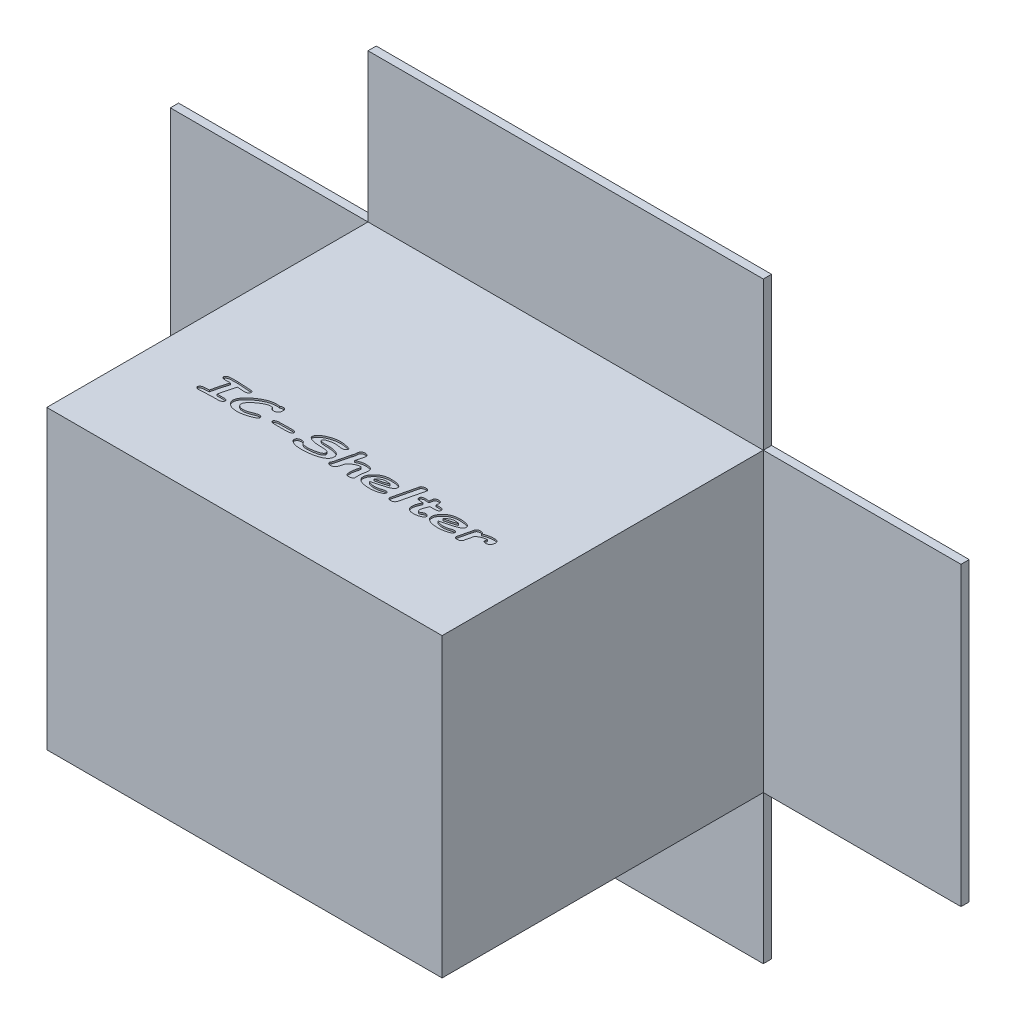
from build123d import *

# Parameters (mm, degrees)
CROQUIS1_W              = 120
CROQUIS1_H              = 90
SALIENTE_EXTRUIR1_DEPTH = 100
CROQUIS2_W              = 115
CROQUIS2_H              = 85
CORTAR_EXTRUIR1_DEPTH   = 97.5
CROQUIS3_W              = 60
CROQUIS3_H              = 90
CROQUIS3_W_2            = 120
CROQUIS3_H_2            = 45
CROQUIS3_W_3            = 115
CROQUIS3_H_3            = 85
SALIENTE_EXTRUIR2_DEPTH = 2.5
CUT_EXTRUDE1_DEPTH      = 0.5


with BuildPart() as part:
    # Croquis1 → Saliente-Extruir1 (new body)
    with BuildSketch(Plane.XY):
        Rectangle(CROQUIS1_W, CROQUIS1_H)
    extrude(amount=SALIENTE_EXTRUIR1_DEPTH)

    # Croquis2 → Cortar-Extruir1 (cut)
    with BuildSketch(Plane(origin=(0, 0, 0), x_dir=(-1, 0, 0), z_dir=(0, 0, -1))):
        Rectangle(CROQUIS2_W, CROQUIS2_H)
    extrude(amount=-CORTAR_EXTRUIR1_DEPTH, mode=Mode.SUBTRACT)

    # Croquis3 → Saliente-Extruir2 (add)
    # profile 1 of 5: a face of its own
    with BuildSketch(Plane(origin=(0, 0, 0), x_dir=(-1, 0, 0), z_dir=(0, 0, -1))):
        with Locations((-90, 0)):
            Rectangle(CROQUIS3_W, CROQUIS3_H)
    # profile 2 of 5: a face of its own
    with BuildSketch(Plane(origin=(0, 0, 0), x_dir=(-1, 0, 0), z_dir=(0, 0, -1))):
        with Locations((0, 67.5)):
            Rectangle(CROQUIS3_W_2, CROQUIS3_H_2)
    # profile 3 of 5: a face of its own
    with BuildSketch(Plane(origin=(0, 0, 0), x_dir=(-1, 0, 0), z_dir=(0, 0, -1))):
        Rectangle(CROQUIS3_W_2, CROQUIS3_H)
        Rectangle(CROQUIS3_W_3, CROQUIS3_H_3, mode=Mode.SUBTRACT)
    # profile 4 of 5: a face of its own
    with BuildSketch(Plane(origin=(0, 0, 0), x_dir=(-1, 0, 0), z_dir=(0, 0, -1))):
        with Locations((90, 0)):
            Rectangle(CROQUIS3_W, CROQUIS3_H)
    # profile 5 of 5: a face of its own
    with BuildSketch(Plane(origin=(0, 0, 0), x_dir=(-1, 0, 0), z_dir=(0, 0, -1))):
        with Locations((0, -67.5)):
            Rectangle(CROQUIS3_W_2, CROQUIS3_H_2)
    extrude(amount=-SALIENTE_EXTRUIR2_DEPTH)

    # Sketch1 → Cut-Extrude1 (cut)
    # profile 1 of 10: a face of its own
    with BuildSketch(Plane(origin=(0, 45, 0), x_dir=(1, 0, 0), z_dir=(0, 1, 0))):
        with BuildLine():
            add(Edge.make_bspline(
                [(-36.391944229, -65.742368943), (-36.421039156, -65.830097886), (-36.480825842, -66.010370649), (-36.569560548, -66.28947963), (-36.65708459, -66.585275664), (-36.746907289, -66.896676786), (-36.838935972, -67.2237777), (-36.929614224, -67.568047295), (-37.022994282, -67.928263548), (-37.083178644, -68.174517237), (-37.113865221, -68.300076147)],
                knots=[0, 0, 0, 0, 0.834424358, 1.714644915, 2.643883241, 3.619167685, 4.640571551, 5.711451538, 6.833123476, 8, 8, 8, 8], degree=3))
            Line((-37.113865221, -68.300076147), (-37.662277304, -70.647093963))
            Line((-37.662277304, -70.647093963), (-36.611928737, -70.636249656))
            add(Edge.make_bspline(
                [(-36.611928737, -70.636249656), (-36.504518537, -70.635640084), (-36.299510772, -70.634476629), (-36.007230523, -70.634269682), (-35.744882099, -70.636314491), (-35.511879512, -70.637418971), (-35.304939134, -70.647875751), (-35.124288183, -70.682791855), (-34.968819274, -70.738241011), (-34.840542247, -70.813888581), (-34.741381987, -70.90425485), (-34.66620442, -71.000537106), (-34.619914202, -71.106452679), (-34.614565167, -71.180632805), (-34.611928737, -71.21719466)],
                knots=[0, 0, 0, 0, 1.695125393, 3.2353898, 4.612687375, 5.8352281, 6.913465851, 7.877216561, 8.72805426, 9.506538656, 10.210425567, 10.833053101, 11.424835932, 12, 12, 12, 12], degree=3))
            add(Edge.make_bspline(
                [(-34.611928737, -71.21719466), (-34.613264092, -71.244629609), (-34.615910232, -71.298994721), (-34.632909886, -71.379981832), (-34.665302636, -71.456586167), (-34.705024697, -71.532985044), (-34.76060253, -71.603583812), (-34.826503476, -71.67253672), (-34.904180986, -71.739198655), (-35.023713426, -71.822561878), (-35.188029003, -71.9142691), (-35.403729803, -71.991055263), (-35.634325642, -72.039329763), (-35.793196696, -72.044772711), (-35.874515879, -72.047558719)],
                knots=[0, 0, 0, 0, 0.596914524, 1.182846205, 1.787632469, 2.400703863, 3.049848028, 3.732978695, 4.473602427, 5.271291247, 6.899882998, 8.548296223, 10.233222955, 12, 12, 12, 12], degree=3))
            Line((-35.874515879, -72.047558719), (-36.424477149, -72.047558719))
            add(Edge.make_bspline(
                [(-36.424477149, -72.047558719), (-36.480766538, -72.047302285), (-36.598001814, -72.046768206), (-36.782332663, -72.051176428), (-36.982199748, -72.053396853), (-37.121097384, -72.056697429), (-37.192873741, -72.058403025)],
                knots=[0, 0, 0, 0, 0.878917605, 1.830543048, 2.878917449, 4, 4, 4, 4], degree=3))
            Line((-37.192873741, -72.058403025), (-37.969016266, -72.069247332))
            add(Edge.make_bspline(
                [(-37.969016266, -72.069247332), (-38.071785687, -72.070475219), (-38.273215675, -72.0728819), (-38.569063217, -72.081858836), (-38.853143777, -72.088541528), (-39.125839114, -72.099269896), (-39.386521904, -72.114156873), (-39.635560012, -72.126998152), (-39.872544387, -72.144494093), (-40.026863009, -72.157429087), (-40.102246321, -72.163747719)],
                knots=[0, 0, 0, 0, 1.154863003, 2.263553109, 3.325838429, 4.347916199, 5.32995742, 6.259852634, 7.149953064, 8, 8, 8, 8], degree=3))
            add(Edge.make_bspline(
                [(-40.102246321, -72.163747719), (-40.184342271, -72.171611426), (-40.343321792, -72.186839563), (-40.574668342, -72.207055749), (-40.791046989, -72.224090075), (-40.992957916, -72.238176408), (-41.180419104, -72.249117017), (-41.353941059, -72.256899736), (-41.513009857, -72.261863921), (-41.614249412, -72.262563695), (-41.662277304, -72.262895667)],
                knots=[0, 0, 0, 0, 1.265777904, 2.451189919, 3.564204359, 4.597008484, 5.557618765, 6.446178635, 7.262869491, 8, 8, 8, 8], degree=3))
            add(Edge.make_bspline(
                [(-41.662277304, -72.262895667), (-41.728538368, -72.261056979), (-41.855733545, -72.257527421), (-42.036891282, -72.224064342), (-42.20013977, -72.17273829), (-42.340857874, -72.098631903), (-42.456157464, -72.010043823), (-42.542084663, -71.909683093), (-42.593842124, -71.79639396), (-42.600732395, -71.717040549), (-42.604182804, -71.677303103)],
                knots=[0, 0, 0, 0, 1.300042434, 2.495570096, 3.605210993, 4.648595855, 5.602105813, 6.444821236, 7.221220225, 8, 8, 8, 8], degree=3))
            add(Edge.make_bspline(
                [(-42.604182804, -71.677303103), (-42.602852507, -71.649856047), (-42.600191913, -71.594961936), (-42.582929418, -71.513855054), (-42.553123108, -71.435509051), (-42.510231054, -71.360247504), (-42.455721612, -71.287806091), (-42.390146865, -71.217243473), (-42.311601504, -71.151291424), (-42.193653385, -71.063581414), (-42.027003938, -70.971522372), (-41.808038073, -70.891865479), (-41.572553865, -70.842513979), (-41.409487695, -70.837241588), (-41.326103796, -70.834545551)],
                knots=[0, 0, 0, 0, 0.588916684, 1.177833367, 1.770490561, 2.380702692, 3.030001756, 3.712037184, 4.442737568, 5.227238536, 6.864137063, 8.50466911, 10.212662271, 12, 12, 12, 12], degree=3))
            add(Edge.make_bspline(
                [(-41.326103796, -70.834545551), (-41.215062257, -70.833651475), (-40.987732849, -70.831821081), (-40.639662428, -70.816392328), (-40.276896857, -70.796169024), (-40.030924932, -70.773362974), (-39.905499613, -70.761733777)],
                knots=[0, 0, 0, 0, 0.936374852, 1.916990193, 2.937837433, 4, 4, 4, 4], degree=3))
            add(Edge.make_bspline(
                [(-39.905499613, -70.761733777), (-39.872446053, -70.610947725), (-39.807682309, -70.315503924), (-39.712466695, -69.880789981), (-39.615580892, -69.464995278), (-39.523187654, -69.066083716), (-39.431454332, -68.685696049), (-39.343473124, -68.322981013), (-39.257313991, -67.978234486), (-39.169175614, -67.652640661), (-39.088898357, -67.34342704), (-39.00536728, -67.053878351), (-38.927311495, -66.781304684), (-38.849992452, -66.527154067), (-38.773437485, -66.291515988), (-38.701443473, -66.073128191), (-38.630201475, -65.872692526), (-38.581210244, -65.745884085), (-38.557707204, -65.685049036)],
                knots=[0, 0, 0, 0, 1.409503133, 2.761720712, 4.063346664, 5.307723472, 6.500541717, 7.636146416, 8.715696943, 9.745034492, 10.716055445, 11.632516357, 12.496519676, 13.304942534, 14.057963606, 14.758760751, 15.404528207, 16, 16, 16, 16], degree=3))
            Line((-38.557707204, -65.685049036), (-40.274206042, -65.722229516))
            add(Edge.make_bspline(
                [(-40.274206042, -65.722229516), (-40.33631298, -65.721987293), (-40.45718194, -65.721515891), (-40.631525626, -65.690546204), (-40.794406293, -65.641461226), (-40.940092978, -65.569742671), (-41.06600759, -65.483289194), (-41.155386152, -65.375559402), (-41.215372176, -65.255928033), (-41.221018179, -65.169337714), (-41.223857475, -65.125792646)],
                knots=[0, 0, 0, 0, 1.19911412, 2.333647126, 3.410816493, 4.47831244, 5.465164417, 6.337247887, 7.163825076, 8, 8, 8, 8], degree=3))
            add(Edge.make_bspline(
                [(-41.223857475, -65.125792646), (-41.219683409, -65.073966351), (-41.211249317, -64.96924644), (-41.139724543, -64.819349706), (-41.025375991, -64.682562686), (-40.872920788, -64.553792986), (-40.680504403, -64.444795309), (-40.452297325, -64.364005443), (-40.192613759, -64.307780156), (-39.950752587, -64.289708986), (-39.728420847, -64.282336071), (-39.523884671, -64.278116176), (-39.28583125, -64.273484696), (-39.01473203, -64.268533754), (-38.710566379, -64.265553624), (-38.372837217, -64.264564496), (-38.001551326, -64.26241751), (-37.742835376, -64.262731889), (-37.608055771, -64.262895667)],
                knots=[0, 0, 0, 0, 0.618719583, 1.250181189, 1.949877174, 2.74458748, 3.62879658, 4.584135527, 5.635242646, 6.803356594, 7.484500143, 8.301543458, 9.254695376, 10.337776208, 11.550711677, 12.899736927, 14.384899606, 16, 16, 16, 16], degree=3))
            add(Edge.make_bspline(
                [(-37.608055771, -64.262895667), (-37.430921432, -64.26431662), (-37.062121646, -64.267275095), (-36.487779974, -64.284944331), (-35.870113609, -64.314814916), (-35.335743332, -64.348700109), (-34.909940253, -64.380317627), (-34.618016192, -64.399285663), (-34.359385448, -64.420069479), (-34.133155099, -64.438120946), (-33.939632264, -64.456055769), (-33.778797191, -64.468583347), (-33.651317452, -64.482913025), (-33.527453017, -64.498423679), (-33.40221528, -64.521704848), (-33.26953452, -64.557179451), (-33.156487597, -64.608956148), (-33.059372246, -64.669056772), (-32.981239928, -64.742386187), (-32.925935815, -64.829806641), (-32.891415192, -64.929664566), (-32.887944676, -65.000531465), (-32.886134779, -65.037489005)],
                knots=[0, 0, 0, 0, 2.120830463, 4.415641992, 6.879182383, 9.524492909, 10.826180232, 11.991314523, 13.026958917, 13.9326856, 14.708517133, 15.353927264, 15.863958023, 16.244335896, 16.848224022, 17.388357983, 17.883673758, 18.331315742, 18.751106396, 19.154172956, 19.558895798, 20, 20, 20, 20], degree=3))
            add(Edge.make_bspline(
                [(-32.886134779, -65.037489005), (-32.887230589, -65.068588452), (-32.889387881, -65.12981313), (-32.909316347, -65.218647611), (-32.937840357, -65.304060135), (-32.983203429, -65.383015623), (-33.036527816, -65.459843931), (-33.105306921, -65.529668658), (-33.183804077, -65.596806591), (-33.307375673, -65.67646401), (-33.477390593, -65.761856669), (-33.699238558, -65.837057702), (-33.938934826, -65.880414132), (-34.104136643, -65.88644409), (-34.189000775, -65.889541678)],
                knots=[0, 0, 0, 0, 0.650015296, 1.279668323, 1.898464449, 2.527374741, 3.178288221, 3.851093165, 4.572182996, 5.336689543, 6.922313598, 8.542599201, 10.223934103, 12, 12, 12, 12], degree=3))
            add(Edge.make_bspline(
                [(-34.189000775, -65.889541678), (-34.228255787, -65.889321257), (-34.322317344, -65.888793094), (-34.485412308, -65.879021551), (-34.693651509, -65.869635018), (-34.94652414, -65.850822183), (-35.244578666, -65.831652914), (-35.587518611, -65.806899363), (-35.974659071, -65.77494521), (-36.24786094, -65.753617116), (-36.391944229, -65.742368943)],
                knots=[0, 0, 0, 0, 0.426596303, 1.022195883, 1.775312909, 2.692251372, 3.77794225, 5.021578525, 6.429217315, 8, 8, 8, 8], degree=3))
        make_face()
    # profile 2 of 10: a face of its own
    with BuildSketch(Plane(origin=(0, 45, 0), x_dir=(1, 0, 0), z_dir=(0, 1, 0))):
        with BuildLine():
            add(Edge.make_bspline(
                [(-24.99302866, -64.32641232), (-24.923586006, -64.291516205), (-24.786060321, -64.222407207), (-24.567510672, -64.151865009), (-24.343110564, -64.108000261), (-24.191269922, -64.102836888), (-24.114639814, -64.100231066)],
                knots=[0, 0, 0, 0, 1.016493721, 2.013085447, 2.997254791, 4, 4, 4, 4], degree=3))
            add(Edge.make_bspline(
                [(-24.114639814, -64.100231066), (-24.04683082, -64.102444822), (-23.919441777, -64.106603685), (-23.741411941, -64.141251709), (-23.589772349, -64.202063978), (-23.464373802, -64.288064063), (-23.366073984, -64.400139794), (-23.299300214, -64.538201114), (-23.258889999, -64.699046851), (-23.254209908, -64.814149139), (-23.251742835, -64.874824404)],
                knots=[0, 0, 0, 0, 1.224973863, 2.301291288, 3.259789022, 4.158237868, 5.024852524, 5.922282693, 6.904747692, 8, 8, 8, 8], degree=3))
            add(Edge.make_bspline(
                [(-23.251742835, -64.874824404), (-23.252989834, -64.949217281), (-23.255392061, -65.092528264), (-23.271990268, -65.298579335), (-23.300685257, -65.486776561), (-23.342500477, -65.656220071), (-23.394595549, -65.808350307), (-23.459655443, -65.94203845), (-23.535392496, -66.058902787), (-23.625192257, -66.155849908), (-23.725220605, -66.236837454), (-23.831383732, -66.308784821), (-23.947657259, -66.366967409), (-24.069828996, -66.417764325), (-24.20127021, -66.453640604), (-24.339710836, -66.482769034), (-24.487179471, -66.497169805), (-24.588152096, -66.500014794), (-24.639814098, -66.501470415)],
                knots=[0, 0, 0, 0, 1.449106255, 2.791568904, 4.023665712, 5.153273804, 6.187236814, 7.149996704, 8.042789494, 8.889988098, 9.711721261, 10.545920451, 11.382723587, 12.240132632, 13.118931386, 14.032341007, 14.993259803, 16, 16, 16, 16], degree=3))
            add(Edge.make_bspline(
                [(-24.639814098, -66.501470415), (-24.697221501, -66.50012206), (-24.807383904, -66.497534622), (-24.964909933, -66.474142101), (-25.107340282, -66.436032627), (-25.233574461, -66.381731707), (-25.345228597, -66.313146519), (-25.438156991, -66.226302138), (-25.51887597, -66.126226338), (-25.555364271, -66.048480297), (-25.573973664, -66.008829052)],
                knots=[0, 0, 0, 0, 1.224964155, 2.350654923, 3.391057907, 4.363844203, 5.275353854, 6.172685915, 7.068051851, 8, 8, 8, 8], degree=3))
            add(Edge.make_bspline(
                [(-25.573973664, -66.008829052), (-25.588958408, -65.973726613), (-25.616554013, -65.909082665), (-25.66919219, -65.826658938), (-25.72663662, -65.766905956), (-25.782078966, -65.734435012), (-25.833452728, -65.721078166), (-25.88279873, -65.709580057), (-25.944659813, -65.703010515), (-26.018037872, -65.697168141), (-26.103165509, -65.689997385), (-26.20089059, -65.688456307), (-26.310322171, -65.684052722), (-26.387290823, -65.684706733), (-26.427575523, -65.685049036)],
                knots=[0, 0, 0, 0, 1.372409776, 2.527402382, 3.500154699, 4.332575148, 4.797331742, 5.406287039, 6.15568453, 7.032585518, 8.057750497, 9.229527133, 10.549959426, 12, 12, 12, 12], degree=3))
            add(Edge.make_bspline(
                [(-26.427575523, -65.685049036), (-26.478200769, -65.686612382), (-26.581726174, -65.689809326), (-26.739972727, -65.704359791), (-26.902815676, -65.736040382), (-27.072006676, -65.77323249), (-27.245386186, -65.826381082), (-27.426320332, -65.885365438), (-27.610723352, -65.9612784), (-27.80266546, -66.044281874), (-27.998086144, -66.141268465), (-28.201313832, -66.245947619), (-28.407326432, -66.366680891), (-28.622125809, -66.493921665), (-28.839461572, -66.636530518), (-29.065649508, -66.785415244), (-29.293342403, -66.951194653), (-29.526494494, -67.121450805), (-29.753780386, -67.29708112), (-29.970041741, -67.472315709), (-30.17047916, -67.645453625), (-30.357696334, -67.814630807), (-30.529337652, -67.981462341), (-30.686050694, -68.145666724), (-30.827685056, -68.306544777), (-30.952881399, -68.465801975), (-31.067712016, -68.619272714), (-31.162479882, -68.773500549), (-31.246605703, -68.922287958), (-31.312687336, -69.069972426), (-31.36638661, -69.214026237), (-31.404046774, -69.356116082), (-31.42627175, -69.495343998), (-31.429748522, -69.587377107), (-31.43144849, -69.632376689)],
                knots=[0, 0, 0, 0, 0.723971577, 1.480475766, 2.268100907, 3.093555508, 3.955401563, 4.858731483, 5.812722359, 6.804267347, 7.84743865, 8.9303564, 10.071122491, 11.259789914, 12.498488744, 13.786185195, 15.129909685, 16.523552773, 17.912849586, 19.235115611, 20.501694908, 21.698311233, 22.841462868, 23.922189826, 24.942228303, 25.903643345, 26.817526963, 27.67975224, 28.489177071, 29.258889757, 29.98978945, 30.684457465, 31.356765578, 32, 32, 32, 32], degree=3))
            add(Edge.make_bspline(
                [(-31.43144849, -69.632376689), (-31.429904875, -69.670698952), (-31.42685514, -69.746412606), (-31.404096839, -69.857796557), (-31.36858758, -69.965118741), (-31.318226966, -70.06888069), (-31.252637481, -70.167880466), (-31.173054399, -70.26290898), (-31.078804625, -70.352770738), (-30.972883563, -70.439433199), (-30.854354358, -70.51737745), (-30.726530072, -70.586419522), (-30.589542836, -70.642810733), (-30.445606487, -70.691904111), (-30.292235578, -70.726666354), (-30.130815585, -70.752728617), (-29.960645156, -70.770876706), (-29.844097079, -70.772003481), (-29.784663052, -70.772578083)],
                knots=[0, 0, 0, 0, 0.828970275, 1.637804318, 2.45072088, 3.270523446, 4.126115895, 5.014795844, 5.947507741, 6.940736313, 7.973004756, 9.01310951, 10.080071187, 11.175741335, 12.300831055, 13.478646966, 14.71422878, 16, 16, 16, 16], degree=3))
            add(Edge.make_bspline(
                [(-29.784663052, -70.772578083), (-29.676667027, -70.770920561), (-29.464950551, -70.767671138), (-29.153608023, -70.738352234), (-28.854308474, -70.694567998), (-28.609362566, -70.64027291), (-28.408254478, -70.583978702), (-28.239426091, -70.530973578), (-28.051530038, -70.46710388), (-27.844372309, -70.392018862), (-27.61669487, -70.309874348), (-27.372005007, -70.211905798), (-27.106572507, -70.107355905), (-26.923737418, -70.03230262), (-26.828814872, -69.993337185)],
                knots=[0, 0, 0, 0, 1.261728113, 2.473504281, 3.651235237, 4.794703506, 5.402302082, 6.091318288, 6.862270202, 7.721205251, 8.666234199, 9.690463411, 10.800957226, 12, 12, 12, 12], degree=3))
            add(Edge.make_bspline(
                [(-26.828814872, -69.993337185), (-26.774676413, -69.971949412), (-26.670394445, -69.930752098), (-26.519219672, -69.875002023), (-26.379390095, -69.827880261), (-26.250530123, -69.790761137), (-26.133223144, -69.761337383), (-26.027994268, -69.738884172), (-25.934227057, -69.725792324), (-25.875580975, -69.723364071), (-25.848179706, -69.722229516)],
                knots=[0, 0, 0, 0, 1.366782782, 2.632708791, 3.783022587, 4.83065754, 5.780547145, 6.622365891, 7.356326591, 8, 8, 8, 8], degree=3))
            add(Edge.make_bspline(
                [(-25.848179706, -69.722229516), (-25.780365194, -69.723951935), (-25.650501787, -69.727250332), (-25.465903239, -69.762023232), (-25.300896349, -69.817218285), (-25.158105446, -69.894136439), (-25.041234604, -69.987715469), (-24.952974346, -70.09520421), (-24.900687265, -70.218814657), (-24.894101383, -70.305808436), (-24.890782339, -70.349650121)],
                knots=[0, 0, 0, 0, 1.282156439, 2.455303434, 3.540163097, 4.563538787, 5.5083901, 6.357055029, 7.172015788, 8, 8, 8, 8], degree=3))
            add(Edge.make_bspline(
                [(-24.890782339, -70.349650121), (-24.893864572, -70.392598219), (-24.900131793, -70.479926203), (-24.959816621, -70.60372294), (-25.051636456, -70.71914935), (-25.155301816, -70.807398587), (-25.259885396, -70.879791718), (-25.362176946, -70.938804347), (-25.484088125, -71.004419822), (-25.626877542, -71.075296668), (-25.790454139, -71.15259529), (-25.975328848, -71.234120224), (-26.179476013, -71.322757413), (-26.478122817, -71.445822677), (-26.863313046, -71.597155221), (-27.334300154, -71.751894157), (-27.803137493, -71.890322597), (-28.27251627, -72.000531534), (-28.738910658, -72.090671144), (-29.203051501, -72.1510751), (-29.663584878, -72.192683861), (-29.969958629, -72.197154687), (-30.122385747, -72.199379013)],
                knots=[0, 0, 0, 0, 0.444928896, 0.904690677, 1.402768158, 1.974435138, 2.314556478, 2.726826476, 3.203239234, 3.756394078, 4.386674805, 5.08723395, 5.860458507, 6.704360486, 8.45109137, 10.168704137, 11.865505725, 13.540348646, 15.187831959, 16.81011627, 18.412968533, 20, 20, 20, 20], degree=3))
            add(Edge.make_bspline(
                [(-30.122385747, -72.199379013), (-30.2525914, -72.197417193), (-30.506713727, -72.193588311), (-30.877716039, -72.160311105), (-31.229502576, -72.107281877), (-31.561161901, -72.029303863), (-31.873910762, -71.932305635), (-32.166989123, -71.813376069), (-32.43882198, -71.669504409), (-32.690324927, -71.508580263), (-32.915915189, -71.330906951), (-33.11311419, -71.143268865), (-33.282550912, -70.94945413), (-33.420430607, -70.746825613), (-33.527239205, -70.535355894), (-33.603453097, -70.316137771), (-33.650104848, -70.088764245), (-33.656137638, -69.934684514), (-33.659178931, -69.857008757)],
                knots=[0, 0, 0, 0, 1.332105439, 2.599869719, 3.808311048, 4.969562193, 6.082613766, 7.156117581, 8.200832637, 9.225374815, 10.207434826, 11.134337898, 12.007237678, 12.836756364, 13.635494044, 14.424259093, 15.205626417, 16, 16, 16, 16], degree=3))
            add(Edge.make_bspline(
                [(-33.659178931, -69.857008757), (-33.656959229, -69.786151963), (-33.652483207, -69.643269453), (-33.619812578, -69.428141891), (-33.568650714, -69.211038397), (-33.497129377, -68.991611453), (-33.403189107, -68.771460667), (-33.289304591, -68.549179618), (-33.155284084, -68.324497392), (-33.002542617, -68.096400589), (-32.825604503, -67.868917859), (-32.630803803, -67.637873991), (-32.414198997, -67.405786831), (-32.17958198, -67.169546447), (-31.920259978, -66.935086433), (-31.644524985, -66.69445111), (-31.345528232, -66.454897794), (-31.031808821, -66.214275146), (-30.708824893, -65.979680576), (-30.383649799, -65.758378155), (-30.061369919, -65.552111567), (-29.74189503, -65.360879875), (-29.424498586, -65.185962668), (-29.109204405, -65.026015347), (-28.796836006, -64.880282366), (-28.486430223, -64.749574426), (-28.17832062, -64.635005436), (-27.872901968, -64.53565501), (-27.570123684, -64.451293529), (-27.26950981, -64.383937822), (-26.97164324, -64.328024577), (-26.675574629, -64.292325067), (-26.382560724, -64.267303459), (-26.188019781, -64.264358343), (-26.091402014, -64.262895667)],
                knots=[0, 0, 0, 0, 0.676994227, 1.365156785, 2.075009067, 2.806956616, 3.56773472, 4.360095267, 5.192084892, 6.066730664, 6.981767414, 7.94477475, 8.954017038, 10.014873971, 11.125661067, 12.294213004, 13.511989686, 14.786303786, 16.072564605, 17.326407122, 18.544823634, 19.728893934, 20.884114031, 22.007524733, 23.107072547, 24.177619542, 25.225413128, 26.247651517, 27.246219084, 28.227949471, 29.19110854, 30.141129883, 31.076801634, 32, 32, 32, 32], degree=3))
            add(Edge.make_bspline(
                [(-26.091402014, -64.262895667), (-25.980367695, -64.263977068), (-25.771153012, -64.266014682), (-25.476609317, -64.275902489), (-25.221086405, -64.294534086), (-25.06472534, -64.316390457), (-24.99302866, -64.32641232)],
                knots=[0, 0, 0, 0, 1.209985029, 2.279895423, 3.211275595, 4, 4, 4, 4], degree=3))
        make_face()
    # profile 3 of 10: a face of its own
    with BuildSketch(Plane(origin=(0, 45, 0), x_dir=(1, 0, 0), z_dir=(0, 1, 0))):
        with BuildLine():
            add(Edge.make_bspline(
                [(-21.03020914, -69.863205504), (-21.110321222, -69.861418874), (-21.263782294, -69.857996442), (-21.482901294, -69.832361317), (-21.680541197, -69.787642505), (-21.853438089, -69.726183227), (-21.997626631, -69.650178252), (-22.103060154, -69.556847911), (-22.173196171, -69.44870297), (-22.180665108, -69.368392717), (-22.184353215, -69.328736101)],
                knots=[0, 0, 0, 0, 1.388429764, 2.659647746, 3.816948537, 4.892920617, 5.834469316, 6.620214234, 7.318671864, 8, 8, 8, 8], degree=3))
            add(Edge.make_bspline(
                [(-22.184353215, -69.328736101), (-22.183509099, -69.303237726), (-22.181839407, -69.252800981), (-22.157587246, -69.179852826), (-22.123526341, -69.109872015), (-22.076690178, -69.041734999), (-22.013090798, -68.980492252), (-21.937630522, -68.921194048), (-21.849486873, -68.863644589), (-21.711199898, -68.79422504), (-21.520839547, -68.718426659), (-21.274227912, -68.654397235), (-21.009307021, -68.614435457), (-20.826898481, -68.610430883), (-20.732765298, -68.608364296)],
                knots=[0, 0, 0, 0, 0.520095447, 1.028768394, 1.558669782, 2.113336486, 2.711775248, 3.359431434, 4.078336743, 4.863751996, 6.52569951, 8.265455015, 10.072762368, 12, 12, 12, 12], degree=3))
            Line((-20.732765298, -68.608364296), (-17.014717273, -68.555691949))
            add(Edge.make_bspline(
                [(-17.014717273, -68.555691949), (-16.933056726, -68.55747163), (-16.776508516, -68.560883387), (-16.552281036, -68.586722211), (-16.349048642, -68.631303079), (-16.169879525, -68.692675594), (-16.020350744, -68.769113907), (-15.907552939, -68.860567014), (-15.836044875, -68.972191762), (-15.827589696, -69.054134309), (-15.823392719, -69.094808912)],
                knots=[0, 0, 0, 0, 1.378735423, 2.643119248, 3.804567801, 4.885622984, 5.833527401, 6.625166498, 7.317560783, 8, 8, 8, 8], degree=3))
            add(Edge.make_bspline(
                [(-15.823392719, -69.094808912), (-15.826989538, -69.142565402), (-15.834243748, -69.238882622), (-15.904272535, -69.373408639), (-16.01311288, -69.493283431), (-16.13209342, -69.581177447), (-16.249175376, -69.643459599), (-16.354948949, -69.686787542), (-16.476158739, -69.722804031), (-16.610976988, -69.755707209), (-16.760675566, -69.781318927), (-16.925027212, -69.802741998), (-17.104286161, -69.820132592), (-17.265133385, -69.827798492), (-17.407651761, -69.834486177), (-17.533177336, -69.8370044), (-17.675206719, -69.839700463), (-17.834207309, -69.845300261), (-18.009285069, -69.848175125), (-18.201405769, -69.848716051), (-18.409487394, -69.853179985), (-18.635178083, -69.853266571), (-18.876828088, -69.857703388), (-19.135555313, -69.858452557), (-19.410275843, -69.860067135), (-19.702037001, -69.862240961), (-20.010330719, -69.860992797), (-20.335654366, -69.86384331), (-20.677511381, -69.86303407), (-20.910921904, -69.863147523), (-21.03020914, -69.863205504)],
                knots=[0, 0, 0, 0, 0.720432265, 1.452996933, 2.247040401, 3.165573777, 3.68098973, 4.257335542, 4.896925911, 5.598350617, 6.362434186, 7.200399242, 8.113600939, 9.094794573, 9.643907055, 10.278919397, 11.000118578, 11.79986579, 12.693452039, 13.657468089, 14.71561562, 15.852046773, 17.082597973, 18.383608375, 19.778664423, 21.252091998, 22.811708699, 24.457554027, 26.189590664, 28, 28, 28, 28], degree=3))
        make_face()
    # profile 4 of 10: a face of its own
    with BuildSketch(Plane(origin=(0, 45, 0), x_dir=(1, 0, 0), z_dir=(0, 1, 0))):
        with BuildLine():
            add(Edge.make_bspline(
                [(-14.054221534, -70.856234164), (-14.053111018, -70.821544261), (-14.050939401, -70.753708058), (-14.03139036, -70.654254727), (-14.000529338, -70.560166224), (-13.958101229, -70.469615439), (-13.902055051, -70.385299019), (-13.834570743, -70.304587011), (-13.753277208, -70.231124667), (-13.63085788, -70.137527527), (-13.457030153, -70.039514339), (-13.227329214, -69.953431379), (-12.9760349, -69.9037103), (-12.80218208, -69.897426295), (-12.712625871, -69.894189238)],
                knots=[0, 0, 0, 0, 0.681077813, 1.331849559, 1.983253891, 2.62325647, 3.290280482, 3.967188005, 4.685282331, 5.438234586, 6.992623228, 8.585260237, 10.240976777, 12, 12, 12, 12], degree=3))
            add(Edge.make_bspline(
                [(-12.712625871, -69.894189238), (-12.657842235, -69.895776806), (-12.552463195, -69.898830572), (-12.400590938, -69.919237984), (-12.263685475, -69.959724233), (-12.137591034, -70.00852227), (-12.028161561, -70.07966136), (-11.929076706, -70.160834209), (-11.845544012, -70.26073996), (-11.802153212, -70.336026418), (-11.780015492, -70.374437107)],
                knots=[0, 0, 0, 0, 1.186939254, 2.283136479, 3.306374803, 4.274322585, 5.199108147, 6.119962183, 7.040816219, 8, 8, 8, 8], degree=3))
            add(Edge.make_bspline(
                [(-11.780015492, -70.374437107), (-11.767314554, -70.400674518), (-11.741671035, -70.453648521), (-11.689322354, -70.526249466), (-11.628588204, -70.594724848), (-11.558633224, -70.659014987), (-11.476872067, -70.71621839), (-11.385360563, -70.768530769), (-11.283901492, -70.816773607), (-11.172666273, -70.860010089), (-11.050784871, -70.896901961), (-10.919373443, -70.929144894), (-10.77771972, -70.956925861), (-10.625853609, -70.980462925), (-10.463424128, -70.996685787), (-10.291398675, -71.009077648), (-10.109546114, -71.016907341), (-9.985032332, -71.018222396), (-9.920991479, -71.018898765)],
                knots=[0, 0, 0, 0, 0.676089185, 1.365041348, 2.070405577, 2.800731052, 3.566364586, 4.383289781, 5.247222651, 6.174005844, 7.153046793, 8.203430918, 9.316287451, 10.505661366, 11.772214056, 13.107307759, 14.51220906, 16, 16, 16, 16], degree=3))
            add(Edge.make_bspline(
                [(-9.920991479, -71.018898765), (-9.81355593, -71.017671186), (-9.595948157, -71.015184757), (-9.266273859, -70.995764711), (-8.929916644, -70.964791154), (-8.587336794, -70.921387798), (-8.238844, -70.864789725), (-7.883508804, -70.799199543), (-7.52229719, -70.717181142), (-7.219082915, -70.642151306), (-6.980507269, -70.574383337), (-6.811980405, -70.522064489), (-6.654693012, -70.467894276), (-6.50915376, -70.411172877), (-6.37572148, -70.35018345), (-6.253380611, -70.288824437), (-6.14236417, -70.225167991), (-6.043484991, -70.158903756), (-5.955629366, -70.090393304), (-5.879690237, -70.019544625), (-5.815203308, -69.945928795), (-5.762099773, -69.870360223), (-5.721657502, -69.791958064), (-5.691131139, -69.712204984), (-5.673934323, -69.628974601), (-5.671334987, -69.572548407), (-5.670023238, -69.544073049)],
                knots=[0, 0, 0, 0, 1.62510855, 3.291613012, 4.993909728, 6.734069037, 8.514029162, 10.334143497, 12.199017557, 14.116342177, 15.058439158, 15.950362607, 16.785361422, 17.574485425, 18.312131664, 19.003842336, 19.644296426, 20.246598944, 20.802923681, 21.32792911, 21.815136144, 22.28102324, 22.721252593, 23.146391916, 23.569228503, 24, 24, 24, 24], degree=3))
            add(Edge.make_bspline(
                [(-5.670023238, -69.544073049), (-5.672033259, -69.506783719), (-5.675959668, -69.433942112), (-5.700032068, -69.328758017), (-5.745241843, -69.23371167), (-5.806291717, -69.147476229), (-5.885451382, -69.070260795), (-5.982633022, -69.004493434), (-6.095879466, -68.946321487), (-6.230333704, -68.898143391), (-6.392911247, -68.855455972), (-6.591731936, -68.822433928), (-6.829678539, -68.788920972), (-7.107921454, -68.764396291), (-7.42556115, -68.74274023), (-7.782997504, -68.726139659), (-8.180153158, -68.713846871), (-8.458550507, -68.709687861), (-8.604182804, -68.707512243)],
                knots=[0, 0, 0, 0, 0.541087748, 1.056969965, 1.552839837, 2.057788428, 2.582082322, 3.14715335, 3.753404441, 4.423965595, 5.214168375, 6.188132081, 7.344714645, 8.698760171, 10.237611651, 11.96208468, 13.88772815, 16, 16, 16, 16], degree=3))
            add(Edge.make_bspline(
                [(-8.604182804, -68.707512243), (-8.720409802, -68.704759714), (-8.949425255, -68.699336089), (-9.286704331, -68.676513695), (-9.612522554, -68.647175668), (-9.925391824, -68.602547851), (-10.227134403, -68.551211968), (-10.516222996, -68.485349196), (-10.794567089, -68.411397265), (-11.05759618, -68.327724076), (-11.299565944, -68.235891194), (-11.510673531, -68.13189689), (-11.691326318, -68.022903464), (-11.838848906, -67.904288745), (-11.957447364, -67.778930185), (-12.038419222, -67.641381314), (-12.092813312, -67.497443471), (-12.098068676, -67.397375236), (-12.100697134, -67.347326341)],
                knots=[0, 0, 0, 0, 1.388980313, 2.736868026, 4.038485895, 5.296795508, 6.51207056, 7.694653735, 8.838151335, 9.952374638, 10.991656061, 11.9271172, 12.761038801, 13.506900539, 14.183859945, 14.809251685, 15.404449989, 16, 16, 16, 16], degree=3))
            add(Edge.make_bspline(
                [(-12.100697134, -67.347326341), (-12.099043621, -67.304897919), (-12.095695933, -67.21899775), (-12.073456255, -67.091166106), (-12.037260844, -66.963380749), (-11.985810387, -66.836964277), (-11.920223572, -66.710247628), (-11.83910098, -66.585701351), (-11.745133206, -66.459821509), (-11.635873266, -66.335992222), (-11.511522944, -66.212612567), (-11.374371878, -66.088419519), (-11.220128184, -65.967560016), (-11.054427653, -65.843119427), (-10.870610187, -65.724794382), (-10.676510974, -65.600285826), (-10.464184224, -65.482877188), (-10.166273919, -65.320710064), (-9.777138054, -65.136128292), (-9.299423568, -64.940220979), (-8.813486102, -64.773387396), (-8.318505034, -64.639298654), (-7.815405302, -64.532805431), (-7.30353455, -64.459615715), (-6.783722869, -64.412953127), (-6.434387467, -64.406910408), (-6.258714175, -64.403871654)],
                knots=[0, 0, 0, 0, 0.437432889, 0.885622356, 1.333969942, 1.804622725, 2.290452178, 2.802976441, 3.335442241, 3.908974895, 4.503860976, 5.141064826, 5.815470126, 6.523669657, 7.276840602, 8.068712312, 8.900876467, 9.777571341, 11.566165099, 13.33808456, 15.099395793, 16.859998611, 18.62277407, 20.398401817, 22.188833411, 24, 24, 24, 24], degree=3))
            add(Edge.make_bspline(
                [(-6.258714175, -64.403871654), (-6.189508054, -64.405073202), (-6.047409148, -64.407540306), (-5.82929001, -64.418084903), (-5.600884526, -64.438406624), (-5.362508162, -64.469052227), (-5.112717033, -64.503636174), (-4.852592484, -64.549444122), (-4.581951583, -64.602065548), (-4.308312716, -64.660286889), (-4.047733725, -64.72473495), (-3.814481231, -64.791601308), (-3.617303394, -64.862581021), (-3.454506011, -64.933948905), (-3.326643387, -65.009139599), (-3.233392743, -65.087220883), (-3.17357023, -65.172416617), (-3.164556276, -65.233537399), (-3.160340821, -65.262121073)],
                knots=[0, 0, 0, 0, 0.998171376, 2.049516125, 3.148523224, 4.304083721, 5.515251585, 6.78488009, 8.112504656, 9.491378635, 10.818940538, 11.983084149, 12.98900413, 13.838928666, 14.543936545, 15.119107206, 15.58804269, 16, 16, 16, 16], degree=3))
            add(Edge.make_bspline(
                [(-3.160340821, -65.262121073), (-3.165595648, -65.30315037), (-3.176948805, -65.391794978), (-3.253127617, -65.520528001), (-3.374147477, -65.646305962), (-3.530479073, -65.774842105), (-3.721019154, -65.888392981), (-3.9380194, -65.97050232), (-4.174288052, -66.021158019), (-4.338494558, -66.027339307), (-4.422927963, -66.030517665)],
                knots=[0, 0, 0, 0, 0.618207422, 1.33564936, 2.200557225, 3.245961458, 4.376552316, 5.527112879, 6.728465238, 8, 8, 8, 8], degree=3))
            add(Edge.make_bspline(
                [(-4.422927963, -66.030517665), (-4.495787707, -66.029364591), (-4.653666136, -66.026866016), (-4.908220277, -66.002006482), (-5.199217937, -65.968970619), (-5.404695713, -65.937302697), (-5.513555383, -65.920525411)],
                knots=[0, 0, 0, 0, 0.796704301, 1.726363767, 2.795454696, 4, 4, 4, 4], degree=3))
            add(Edge.make_bspline(
                [(-5.513555383, -65.920525411), (-5.616205583, -65.904200704), (-5.812810558, -65.872934144), (-6.09663071, -65.841228492), (-6.354924441, -65.818937316), (-6.51893725, -65.816386183), (-6.596436871, -65.815180717)],
                knots=[0, 0, 0, 0, 1.145071271, 2.193144373, 3.146221399, 4, 4, 4, 4], degree=3))
            add(Edge.make_bspline(
                [(-6.596436871, -65.815180717), (-6.768057271, -65.819571391), (-7.112960837, -65.828395278), (-7.630871199, -65.893702752), (-8.149352653, -66.003572599), (-8.574945194, -66.126118524), (-8.897683228, -66.240432181), (-9.109695983, -66.327456227), (-9.28797042, -66.418979406), (-9.436769447, -66.50946475), (-9.552517233, -66.60454325), (-9.636312516, -66.702365196), (-9.691848574, -66.803429761), (-9.698041201, -66.874749893), (-9.701006971, -66.908906511)],
                knots=[0, 0, 0, 0, 1.79055214, 3.598452261, 5.437292654, 7.316568774, 8.214758951, 9.009348424, 9.705813493, 10.303833304, 10.824034153, 11.260065222, 11.645630646, 12, 12, 12, 12], degree=3))
            add(Edge.make_bspline(
                [(-9.701006971, -66.908906511), (-9.697970008, -66.936951309), (-9.691668169, -66.995145551), (-9.6375266, -67.074431993), (-9.552501254, -67.140439026), (-9.439043228, -67.200430924), (-9.294441425, -67.252069671), (-9.118435877, -67.295874726), (-8.910804338, -67.332497798), (-8.761286352, -67.349248173), (-8.681642138, -67.358170647)],
                knots=[0, 0, 0, 0, 0.562321354, 1.166842601, 1.870338452, 2.724051868, 3.74663883, 4.96294183, 6.382240713, 8, 8, 8, 8], degree=3))
            Line((-8.681642138, -67.358170647), (-6.862896979, -67.415490554))
            add(Edge.make_bspline(
                [(-6.862896979, -67.415490554), (-6.688702046, -67.422468453), (-6.350857343, -67.436001834), (-5.861187231, -67.493844695), (-5.403511513, -67.571684862), (-5.045049775, -67.66377444), (-4.777813433, -67.749034413), (-4.592433337, -67.817036352), (-4.42012603, -67.891354798), (-4.26010783, -67.971788554), (-4.113160082, -68.058280119), (-3.978757896, -68.149989349), (-3.857285334, -68.247669412), (-3.748974525, -68.351783046), (-3.651638478, -68.460012923), (-3.569700935, -68.575508599), (-3.499434049, -68.6951421), (-3.441812235, -68.819665479), (-3.396792685, -68.94887698), (-3.36364203, -69.083072536), (-3.345178449, -69.222869944), (-3.342799797, -69.317840213), (-3.341595662, -69.365916581)],
                knots=[0, 0, 0, 0, 2.353890953, 4.565285445, 6.65460196, 8.620347826, 9.55781659, 10.442749396, 11.286250705, 12.091028137, 12.860198368, 13.587630344, 14.286965989, 14.962811593, 15.615029769, 16.249898708, 16.871956332, 17.486737257, 18.099973155, 18.717438726, 19.350734828, 20, 20, 20, 20], degree=3))
            add(Edge.make_bspline(
                [(-3.341595662, -69.365916581), (-3.342974586, -69.425895668), (-3.345708911, -69.544830709), (-3.370890012, -69.72042), (-3.414022059, -69.889880753), (-3.46830271, -70.055565973), (-3.544584228, -70.213779823), (-3.634377509, -70.368294087), (-3.741863876, -70.516630242), (-3.864582805, -70.660279928), (-4.005817979, -70.796061837), (-4.160200221, -70.930194834), (-4.332870748, -71.056482599), (-4.521560501, -71.178281694), (-4.727323976, -71.292851541), (-4.947777857, -71.405585297), (-5.18566718, -71.510258176), (-5.525987775, -71.644664309), (-5.973385949, -71.796361797), (-6.530482675, -71.954079492), (-7.108860229, -72.089081023), (-7.709144916, -72.198624971), (-8.331003605, -72.283769626), (-8.975079186, -72.343035796), (-9.640633515, -72.381610774), (-10.091863823, -72.386102198), (-10.320681642, -72.388379788)],
                knots=[0, 0, 0, 0, 0.523151789, 1.03737956, 1.543348904, 2.047750967, 2.555682604, 3.072666592, 3.605355487, 4.151741, 4.71889249, 5.313172826, 5.934982035, 6.583637274, 7.271616076, 7.988978312, 8.743377911, 9.538243018, 11.181135713, 12.862720753, 14.588474231, 16.361300451, 18.185020089, 20.063143249, 22.003629284, 24, 24, 24, 24], degree=3))
            add(Edge.make_bspline(
                [(-10.320681642, -72.388379788), (-10.465807456, -72.386677491), (-10.747422832, -72.3833742), (-11.15682919, -72.364110839), (-11.540313162, -72.328391274), (-11.898670717, -72.279428713), (-12.231820223, -72.216417119), (-12.54013992, -72.139821839), (-12.821997951, -72.046777489), (-13.078169007, -71.94238526), (-13.30481655, -71.826398856), (-13.503644293, -71.705955819), (-13.671984198, -71.579396057), (-13.810724353, -71.446925923), (-13.920065423, -71.308437413), (-13.99729424, -71.162634535), (-14.044899051, -71.01098251), (-14.051122147, -70.907682371), (-14.054221534, -70.856234164)],
                knots=[0, 0, 0, 0, 1.600614277, 3.10597804, 4.518786591, 5.846949024, 7.093490063, 8.256545677, 9.347952376, 10.36434037, 11.304209407, 12.153028685, 12.92531595, 13.622115754, 14.263481115, 14.862158378, 15.433302683, 16, 16, 16, 16], degree=3))
        make_face()
    # profile 5 of 10: a face of its own
    with BuildSketch(Plane(origin=(0, 45, 0), x_dir=(1, 0, 0), z_dir=(0, 1, 0))):
        with BuildLine():
            add(Edge.make_bspline(
                [(0.666150271, -67.285358874), (0.774871941, -67.225033062), (0.990914872, -67.105158476), (1.326049155, -66.952294194), (1.667363597, -66.823322261), (2.013696958, -66.715814578), (2.366923341, -66.633919094), (2.724925548, -66.574669798), (3.089435937, -66.540265064), (3.334295672, -66.53507276), (3.457784663, -66.532454149)],
                knots=[0, 0, 0, 0, 1.019796592, 2.026457514, 3.018688138, 4.011705361, 4.999294114, 5.991117633, 6.986869538, 8, 8, 8, 8], degree=3))
            add(Edge.make_bspline(
                [(3.457784663, -66.532454149), (3.543002759, -66.533354143), (3.708395802, -66.535100871), (3.948395772, -66.548292425), (4.171508341, -66.573927964), (4.378346168, -66.604793986), (4.568039587, -66.648916278), (4.74222318, -66.700211723), (4.898772825, -66.764329408), (5.040139205, -66.835389499), (5.165918366, -66.91730581), (5.27429337, -67.014320668), (5.364509692, -67.125865468), (5.439880819, -67.249008483), (5.497250495, -67.386045496), (5.539107497, -67.535797716), (5.563996848, -67.699193043), (5.566490747, -67.812510553), (5.567776917, -67.870951437)],
                knots=[0, 0, 0, 0, 1.436149341, 2.787308355, 4.048179761, 5.219950878, 6.309258815, 7.327859985, 8.276472087, 9.15607028, 9.991192662, 10.798463612, 11.59629799, 12.400749591, 13.223492337, 14.09134556, 15.015655634, 16, 16, 16, 16], degree=3))
            add(Edge.make_bspline(
                [(5.567776917, -67.870951437), (5.566488433, -67.923162299), (5.563816122, -68.031447471), (5.551115828, -68.139024069), (5.544539117, -68.194731453)],
                knots=[0, 0, 0, 0, 0.964321516, 2, 2, 2, 2], degree=3))
            add(Edge.make_bspline(
                [(5.544539117, -68.194731453), (5.518533249, -68.315945001), (5.467092107, -68.555712553), (5.402989098, -68.913962986), (5.34613798, -69.266007811), (5.301909234, -69.613311533), (5.26547503, -69.955164103), (5.241397689, -70.292072554), (5.224638605, -70.623168905), (5.223079902, -70.8422711), (5.222308288, -70.950734551)],
                knots=[0, 0, 0, 0, 1.070126532, 2.116773442, 3.141352907, 4.148245979, 5.138752772, 6.108733163, 7.063755024, 8, 8, 8, 8], degree=3))
            add(Edge.make_bspline(
                [(5.222308288, -70.950734551), (5.223122115, -71.023550754), (5.224623109, -71.15785029), (5.229770881, -71.342860623), (5.240956579, -71.495030328), (5.254885812, -71.584926285), (5.261037955, -71.624630756)],
                knots=[0, 0, 0, 0, 1.293147172, 2.385033245, 3.286715406, 4, 4, 4, 4], degree=3))
            add(Edge.make_bspline(
                [(5.261037955, -71.624630756), (5.262938098, -71.644267891), (5.266808604, -71.684267857), (5.256095971, -71.745866187), (5.234464783, -71.808609443), (5.197591464, -71.870786582), (5.147983202, -71.933071988), (5.088014475, -71.99858709), (5.012857458, -72.062812446), (4.896664278, -72.15033411), (4.730353664, -72.246944891), (4.504997576, -72.329008328), (4.255758589, -72.379311226), (4.081322647, -72.385279386), (3.99070488, -72.388379788)],
                knots=[0, 0, 0, 0, 0.43670665, 0.889551914, 1.375912855, 1.905446251, 2.486224461, 3.143993172, 3.875967747, 4.679315465, 6.376115259, 8.126331491, 9.987667063, 12, 12, 12, 12], degree=3))
            add(Edge.make_bspline(
                [(3.99070488, -72.388379788), (3.944736701, -72.387246032), (3.856800216, -72.385077174), (3.730221704, -72.375379385), (3.616023961, -72.354559667), (3.51169406, -72.329186789), (3.419609833, -72.293323704), (3.336814757, -72.251918634), (3.267469638, -72.200393633), (3.205993327, -72.141073574), (3.157262276, -72.063737364), (3.114292446, -71.969077434), (3.07936547, -71.853340845), (3.052720831, -71.717209337), (3.029408846, -71.560621817), (3.012699325, -71.382756366), (3.003977938, -71.183719062), (3.002893726, -71.04421045), (3.00232378, -70.970873978)],
                knots=[0, 0, 0, 0, 1.07763555, 2.061501761, 2.970718221, 3.795479333, 4.573082029, 5.282124448, 5.957421137, 6.590637367, 7.271979032, 8.084215928, 9.021976183, 10.097094764, 11.332741074, 12.730753, 14.281431954, 16, 16, 16, 16], degree=3))
            add(Edge.make_bspline(
                [(3.00232378, -70.970873978), (3.006425796, -70.793016603), (3.014645044, -70.436642107), (3.083742264, -69.903971624), (3.187450623, -69.371422779), (3.294046646, -69.02377327), (3.347792409, -68.848488231)],
                knots=[0, 0, 0, 0, 0.988230391, 1.98012654, 2.981578893, 4, 4, 4, 4], degree=3))
            add(Edge.make_bspline(
                [(3.347792409, -68.848488231), (3.366302887, -68.785087664), (3.400611214, -68.667577602), (3.441646226, -68.504163462), (3.467230638, -68.366965592), (3.471418661, -68.284144481), (3.47327653, -68.2474038)],
                knots=[0, 0, 0, 0, 1.286967781, 2.385336156, 3.283711019, 4, 4, 4, 4], degree=3))
            add(Edge.make_bspline(
                [(3.47327653, -68.2474038), (3.472850997, -68.222473018), (3.472049867, -68.175537027), (3.453821982, -68.110616865), (3.428048584, -68.055277941), (3.390831779, -68.009246601), (3.341123138, -67.975054941), (3.281364754, -67.95076507), (3.211778441, -67.934626298), (3.161991158, -67.933511088), (3.135553834, -67.932918905)],
                knots=[0, 0, 0, 0, 1.127822194, 2.123296864, 3.035760904, 3.885499185, 4.776928155, 5.743818628, 6.801955157, 8, 8, 8, 8], degree=3))
            add(Edge.make_bspline(
                [(3.135553834, -67.932918905), (3.078692903, -67.934082698), (2.964157918, -67.936426927), (2.791996822, -67.956573071), (2.617713188, -67.984819021), (2.442814983, -68.029595204), (2.265241076, -68.083703368), (2.086138949, -68.15014702), (1.905759385, -68.229612148), (1.724570199, -68.322084698), (1.539453814, -68.423524077), (1.354671936, -68.540153018), (1.167764122, -68.667995282), (0.978933185, -68.807228623), (0.788396169, -68.959320088), (0.59628843, -69.123733807), (0.402880473, -69.300271347), (0.275434259, -69.423931603), (0.210689388, -69.486753142)],
                knots=[0, 0, 0, 0, 0.803724243, 1.618941899, 2.448422894, 3.298474231, 4.169222268, 5.07254742, 5.997798582, 6.954579672, 7.94818234, 8.981452049, 10.042696702, 11.149677895, 12.298005577, 13.489154859, 14.724447452, 16, 16, 16, 16], degree=3))
            add(Edge.make_bspline(
                [(0.210689388, -69.486753142), (0.191732549, -69.566829966), (0.154627803, -69.723566552), (0.097896212, -69.951987318), (0.039895821, -70.16753851), (-0.015354419, -70.370780979), (-0.070847677, -70.560935728), (-0.12692507, -70.73852339), (-0.182817672, -70.903573521), (-0.23613394, -71.056980114), (-0.290967197, -71.197283492), (-0.34463834, -71.324901238), (-0.397214709, -71.440445697), (-0.449802877, -71.542882396), (-0.502136192, -71.633181103), (-0.554931003, -71.71042272), (-0.605559407, -71.77670889), (-0.67405126, -71.846422052), (-0.763446834, -71.918651616), (-0.875724887, -71.99339297), (-0.993550476, -72.057768883), (-1.118876827, -72.107925423), (-1.249119609, -72.151670751), (-1.387266161, -72.177731085), (-1.531150169, -72.195825623), (-1.62916662, -72.198176267), (-1.679318358, -72.199379013)],
                knots=[0, 0, 0, 0, 1.631399232, 3.193182914, 4.665749498, 6.056583348, 7.368624283, 8.592510939, 9.748262839, 10.823251021, 11.81184763, 12.734020195, 13.567733927, 14.327796417, 15.016074457, 15.635084634, 16.181906134, 16.666974406, 17.56880623, 18.454691772, 19.338741648, 20.224686341, 21.12796969, 22.057556656, 23.006116741, 24, 24, 24, 24], degree=3))
            add(Edge.make_bspline(
                [(-1.679318358, -72.199379013), (-1.74818646, -72.19772355), (-1.880139492, -72.194551641), (-2.067813939, -72.158789595), (-2.237660285, -72.10645821), (-2.383443332, -72.02915164), (-2.503629959, -71.938949326), (-2.592239326, -71.840150308), (-2.65011331, -71.732911231), (-2.65670276, -71.657289544), (-2.659953524, -71.619983196)],
                knots=[0, 0, 0, 0, 1.32562367, 2.539928592, 3.669926233, 4.738460347, 5.703983598, 6.550425459, 7.284883292, 8, 8, 8, 8], degree=3))
            add(Edge.make_bspline(
                [(-2.659953524, -71.619983196), (-2.657670253, -71.589769021), (-2.652865589, -71.526189656), (-2.617026933, -71.430456106), (-2.562176227, -71.330374365), (-2.512751332, -71.266620126), (-2.486444617, -71.232686527)],
                knots=[0, 0, 0, 0, 0.837918833, 1.763223698, 2.809461571, 4, 4, 4, 4], degree=3))
            add(Edge.make_bspline(
                [(-2.486444617, -71.232686527), (-2.4810328, -71.223510695), (-2.467958498, -71.201342983), (-2.452278159, -71.157796933), (-2.430068558, -71.102124714), (-2.407593154, -71.030710155), (-2.379069198, -70.946569268), (-2.350013182, -70.847253677), (-2.319466746, -70.733241236), (-2.283928318, -70.605808206), (-2.24427286, -70.464180096), (-2.205413923, -70.307581292), (-2.159275213, -70.137753775), (-2.113610771, -69.953055619), (-2.063670311, -69.754337227), (-2.011036505, -69.541694763), (-1.957230556, -69.314130168), (-1.919039243, -69.158298182), (-1.899302866, -69.077767859)],
                knots=[0, 0, 0, 0, 0.228300302, 0.551546198, 0.990158419, 1.516072521, 2.157697305, 2.897890136, 3.737085292, 4.692005253, 5.738326159, 6.894646383, 8.15591467, 9.516577313, 10.979421251, 12.555214523, 14.219815506, 16, 16, 16, 16], degree=3))
            Line((-1.899302866, -69.077767859), (-1.231603408, -66.327961507))
            Line((-1.231603408, -66.327961507), (-1.169635941, -66.160649346))
            add(Edge.make_bspline(
                [(-1.169635941, -66.160649346), (-1.128139867, -66.042420198), (-1.048302102, -65.814949263), (-0.960758719, -65.477570512), (-0.906419061, -65.159065303), (-0.898998176, -64.952473772), (-0.895429899, -64.853135791)],
                knots=[0, 0, 0, 0, 1.119520175, 2.153938401, 3.112335191, 4, 4, 4, 4], degree=3))
            add(Edge.make_bspline(
                [(-0.895429899, -64.853135791), (-0.894650191, -64.778640113), (-0.893209275, -64.640970657), (-0.865651168, -64.452291347), (-0.829381171, -64.296012459), (-0.767998186, -64.170453965), (-0.682580259, -64.070466534), (-0.579590636, -63.979404737), (-0.450271469, -63.900055033), (-0.301527659, -63.827857337), (-0.136599942, -63.769447687), (0.037582943, -63.722704708), (0.22036254, -63.69892159), (0.34437987, -63.694860048), (0.407436096, -63.69279497)],
                knots=[0, 0, 0, 0, 1.332709654, 2.462873249, 3.409611406, 4.195534424, 4.938079582, 5.750760495, 6.648853257, 7.645811792, 8.70787772, 9.777968439, 10.870214956, 12, 12, 12, 12], degree=3))
            add(Edge.make_bspline(
                [(0.407436096, -63.69279497), (0.481480038, -63.69472685), (0.621426439, -63.698378193), (0.816621034, -63.736933708), (0.98401189, -63.799482004), (1.121216373, -63.891040755), (1.228348395, -64.009069917), (1.304495697, -64.15315189), (1.347175143, -64.323510397), (1.352643572, -64.444937602), (1.355538342, -64.509216348)],
                knots=[0, 0, 0, 0, 1.240057062, 2.343763974, 3.319722821, 4.217840439, 5.082142864, 5.965278178, 6.922898972, 8, 8, 8, 8], degree=3))
            add(Edge.make_bspline(
                [(1.355538342, -64.509216348), (1.354227822, -64.563483585), (1.351475224, -64.677465756), (1.331361709, -64.856381562), (1.300257832, -65.051233131), (1.256489581, -65.26321994), (1.198502492, -65.490661712), (1.130613036, -65.735403659), (1.047501366, -65.995136941), (0.987095869, -66.173649639), (0.95584818, -66.26599404)],
                knots=[0, 0, 0, 0, 0.719894203, 1.51205607, 2.386110165, 3.337411237, 4.382590191, 5.499666403, 6.706580478, 8, 8, 8, 8], degree=3))
            add(Edge.make_bspline(
                [(0.95584818, -66.26599404), (0.930603183, -66.341759454), (0.878290842, -66.498759523), (0.806370293, -66.744936014), (0.735003458, -67.008976106), (0.689584423, -67.191292122), (0.666150271, -67.285358874)],
                knots=[0, 0, 0, 0, 0.90395249, 1.873158153, 2.902646576, 4, 4, 4, 4], degree=3))
        make_face()
    # profile 6 of 10: a face of its own
    with BuildSketch(Plane(origin=(0, 45, 0), x_dir=(1, 0, 0), z_dir=(0, 1, 0))):
        with BuildLine():
            add(Edge.make_bspline(
                [(8.404337723, -70.495273668), (8.462799183, -70.539004853), (8.5824092, -70.628477263), (8.783620359, -70.738974908), (9.005472924, -70.832334896), (9.247712897, -70.906689944), (9.509329834, -70.968438769), (9.791983061, -71.007927409), (10.09496835, -71.035957151), (10.304084851, -71.037988893), (10.412083656, -71.039038192)],
                knots=[0, 0, 0, 0, 0.826029069, 1.690025387, 2.591585185, 3.547878465, 4.55653139, 5.632583607, 6.777341148, 8, 8, 8, 8], degree=3))
            add(Edge.make_bspline(
                [(10.412083656, -71.039038192), (10.497313279, -71.0382228), (10.665306777, -71.036615606), (10.913257412, -71.021594795), (11.154825361, -71.00114859), (11.388734504, -70.967834858), (11.616364106, -70.928183342), (11.83576195, -70.877948295), (12.049487086, -70.821967269), (12.187202363, -70.774479956), (12.255615802, -70.75088947)],
                knots=[0, 0, 0, 0, 1.090899492, 2.150238559, 3.179024588, 4.193352486, 5.173657867, 6.135877038, 7.073951237, 8, 8, 8, 8], degree=3))
            add(Edge.make_bspline(
                [(12.255615802, -70.75088947), (12.31382093, -70.730301721), (12.426081399, -70.690594046), (12.591429119, -70.640216975), (12.745323669, -70.59433233), (12.890190308, -70.558732211), (13.024546959, -70.530873079), (13.148443513, -70.509814654), (13.262401789, -70.499066631), (13.334866246, -70.496499794), (13.369481022, -70.495273668)],
                knots=[0, 0, 0, 0, 1.290981307, 2.489920904, 3.614366665, 4.648979511, 5.608435131, 6.483728162, 7.275708205, 8, 8, 8, 8], degree=3))
            add(Edge.make_bspline(
                [(13.369481022, -70.495273668), (13.423238634, -70.496335404), (13.524406315, -70.498333509), (13.665384665, -70.516078557), (13.785446072, -70.546693227), (13.884729346, -70.588694851), (13.96310632, -70.646088803), (14.018640318, -70.717404681), (14.053499042, -70.801677829), (14.057035295, -70.862087776), (14.058869094, -70.893414644)],
                knots=[0, 0, 0, 0, 1.443281721, 2.71614495, 3.805954049, 4.762004241, 5.59405158, 6.384618187, 7.162309255, 8, 8, 8, 8], degree=3))
            add(Edge.make_bspline(
                [(14.058869094, -70.893414644), (14.055451243, -70.943589753), (14.048484236, -71.045867598), (13.984165783, -71.192390081), (13.885752877, -71.332052709), (13.744604294, -71.459597041), (13.569741243, -71.584737166), (13.353820101, -71.698598165), (13.101184925, -71.808863077), (12.814873454, -71.909499853), (12.50556633, -72.000009589), (12.185126205, -72.083197751), (11.856119567, -72.150816508), (11.520056988, -72.205874946), (11.177189321, -72.251967342), (10.82666241, -72.281946634), (10.469106891, -72.301260787), (10.228272364, -72.303563274), (10.106893881, -72.304723707)],
                knots=[0, 0, 0, 0, 0.538607599, 1.09790743, 1.697199865, 2.370643477, 3.136893313, 4.011293666, 4.995990704, 6.107098155, 7.280226691, 8.469804883, 9.675197017, 10.899784807, 12.140677099, 13.40377481, 14.691525336, 16, 16, 16, 16], degree=3))
            add(Edge.make_bspline(
                [(10.106893881, -72.304723707), (9.959671809, -72.303644682), (9.673752432, -72.301549113), (9.257234137, -72.273667779), (8.865187298, -72.233287236), (8.4973751, -72.174706675), (8.154183704, -72.099341052), (7.835646764, -72.006753889), (7.541625137, -71.897191007), (7.273837912, -71.770434142), (7.033256676, -71.63086199), (6.824208548, -71.477272614), (6.64654701, -71.312040712), (6.500816827, -71.134798081), (6.387276489, -70.944715735), (6.306102238, -70.74315358), (6.255950202, -70.529214481), (6.250593874, -70.382456905), (6.247869868, -70.30782208)],
                knots=[0, 0, 0, 0, 1.474293617, 2.863219535, 4.179207566, 5.420667036, 6.591474106, 7.696248855, 8.740488176, 9.73069762, 10.660335678, 11.522040579, 12.323392266, 13.08433346, 13.812580785, 14.531957983, 15.253414631, 16, 16, 16, 16], degree=3))
            add(Edge.make_bspline(
                [(6.247869868, -70.30782208), (6.252217942, -70.201141557), (6.260968518, -69.986445103), (6.327311177, -69.666552396), (6.435054203, -69.34969799), (6.588019781, -69.036780732), (6.781666289, -68.725451787), (7.018679357, -68.41713382), (7.298493421, -68.111600346), (7.559708291, -67.862425782), (7.789993652, -67.671574894), (7.970606861, -67.532682351), (8.160318047, -67.406329392), (8.355878045, -67.287809269), (8.558858111, -67.179748259), (8.76824381, -67.080556634), (8.984591865, -66.989852704), (9.208380159, -66.910536089), (9.438410821, -66.837907019), (9.676297525, -66.778827192), (9.920313296, -66.725000455), (10.17191709, -66.684633183), (10.429472147, -66.649183371), (10.694755015, -66.626986262), (10.967044318, -66.612477722), (11.15102608, -66.610774278), (11.243996902, -66.609913482)],
                knots=[0, 0, 0, 0, 1.122424073, 2.258898453, 3.424436275, 4.637678146, 5.916911899, 7.278169147, 8.725137546, 10.274813481, 11.073849311, 11.872977596, 12.6720689, 13.471973378, 14.279397494, 15.091565622, 15.910329192, 16.747721249, 17.590232329, 18.448554356, 19.327123013, 20.219922116, 21.130208661, 22.063354903, 23.021362317, 24, 24, 24, 24], degree=3))
            add(Edge.make_bspline(
                [(11.243996902, -66.609913482), (11.363817056, -66.610657596), (11.597367579, -66.612108005), (11.937390778, -66.627591388), (12.257210338, -66.65391381), (12.555926401, -66.689263933), (12.834966963, -66.73313709), (13.092872039, -66.790519966), (13.330821637, -66.857071362), (13.548055188, -66.931501354), (13.741611508, -67.018251875), (13.911431748, -67.111943355), (14.056253261, -67.214023423), (14.17437436, -67.326728722), (14.267434222, -67.448161219), (14.334070966, -67.579207617), (14.374525487, -67.719322107), (14.37889367, -67.815950346), (14.381099923, -67.864754691)],
                knots=[0, 0, 0, 0, 1.566621335, 3.053620124, 4.449283817, 5.761662678, 6.986050096, 8.140997117, 9.21409472, 10.215617786, 11.140460196, 11.983852983, 12.748364017, 13.450356568, 14.110718808, 14.73881057, 15.36300687, 16, 16, 16, 16], degree=3))
            add(Edge.make_bspline(
                [(14.381099923, -67.864754691), (14.378774771, -67.911371539), (14.374155925, -68.003974569), (14.344365393, -68.140197744), (14.292661628, -68.270567558), (14.217766688, -68.393246491), (14.126113045, -68.512571927), (14.011517037, -68.62387116), (13.876901992, -68.729184317), (13.720302712, -68.832023079), (13.533935406, -68.931116679), (13.314219963, -69.03356614), (13.0568799, -69.137933884), (12.762336314, -69.245272721), (12.431666111, -69.359151134), (12.063486925, -69.47404838), (11.658254841, -69.594044642), (11.374806407, -69.671160519), (11.226955848, -69.71138521)],
                knots=[0, 0, 0, 0, 0.577115387, 1.146423128, 1.717451268, 2.305128479, 2.920228337, 3.575730044, 4.276640807, 5.033782936, 5.891981707, 6.887272362, 8.034114165, 9.328615264, 10.768096169, 12.36341114, 14.103105784, 16, 16, 16, 16], degree=3))
            Line((11.226955848, -69.71138521), (8.404337723, -70.495273668))
        make_face()
        with BuildLine():
            Line((8.54531371, -69.167620686), (10.44306739, -68.665684203))
            add(Edge.make_bspline(
                [(10.44306739, -68.665684203), (10.610562299, -68.616192772), (10.936560812, -68.519866664), (11.408627499, -68.369566361), (11.851013187, -68.21995655), (12.133969495, -68.115315375), (12.271107668, -68.064599772)],
                knots=[0, 0, 0, 0, 1.08884326, 2.119236249, 3.088465255, 4, 4, 4, 4], degree=3))
            add(Edge.make_bspline(
                [(12.271107668, -68.064599772), (12.230470956, -68.049186804), (12.146450085, -68.017318796), (12.012760683, -67.976527083), (11.866324918, -67.945438069), (11.708476704, -67.916419264), (11.538056918, -67.897926127), (11.356310146, -67.881775403), (11.16249877, -67.872647074), (11.02918497, -67.871528023), (10.96049574, -67.870951437)],
                knots=[0, 0, 0, 0, 0.782612339, 1.618137065, 2.513857553, 3.477083365, 4.507168958, 5.599200332, 6.763000658, 8, 8, 8, 8], degree=3))
            add(Edge.make_bspline(
                [(10.96049574, -67.870951437), (10.841985687, -67.874715041), (10.608542655, -67.882128648), (10.265787105, -67.944216286), (9.93894024, -68.047345095), (9.625870841, -68.188899862), (9.329982463, -68.373951039), (9.049965858, -68.59915259), (8.784420582, -68.864109744), (8.626426369, -69.064660117), (8.54531371, -69.167620686)],
                knots=[0, 0, 0, 0, 0.997305381, 1.964508378, 2.921631464, 3.87702465, 4.849510339, 5.851788899, 6.897129769, 8, 8, 8, 8], degree=3))
        make_face(mode=Mode.SUBTRACT)
    # profile 7 of 10: a face of its own
    with BuildSketch(Plane(origin=(0, 45, 0), x_dir=(1, 0, 0), z_dir=(0, 1, 0))):
        with BuildLine():
            add(Edge.make_bspline(
                [(18.001549187, -71.30085074), (17.979626285, -71.379128082), (17.937555878, -71.52934358), (17.838569047, -71.734832876), (17.712511181, -71.909051757), (17.558787521, -72.052505453), (17.377002737, -72.161961335), (17.169003546, -72.23920745), (16.935201234, -72.286085817), (16.770692925, -72.29120482), (16.684740511, -72.2938794)],
                knots=[0, 0, 0, 0, 1.078998771, 2.070616275, 3.013845746, 3.922134708, 4.846263227, 5.815169197, 6.85846811, 8, 8, 8, 8], degree=3))
            add(Edge.make_bspline(
                [(16.684740511, -72.2938794), (16.611250426, -72.291666219), (16.472086515, -72.287475247), (16.275113765, -72.251894055), (16.102035108, -72.192330913), (15.977322075, -72.119840754), (15.893328342, -72.052176199), (15.843383016, -71.996526323), (15.801318524, -71.939501005), (15.773820089, -71.87567294), (15.754849458, -71.809073447), (15.746726143, -71.737845936), (15.752291703, -71.66324825), (15.762419397, -71.613173632), (15.767621998, -71.587450276)],
                knots=[0, 0, 0, 0, 1.956952766, 3.70576793, 5.31163047, 6.810157303, 7.523666002, 8.176193171, 8.798422571, 9.401963052, 10.016230527, 10.639220134, 11.300966686, 12, 12, 12, 12], degree=3))
            Line((15.767621998, -71.587450276), (17.49186677, -64.346551747))
            add(Edge.make_bspline(
                [(17.49186677, -64.346551747), (17.50734059, -64.297279276), (17.538889303, -64.196820367), (17.637974504, -64.065322482), (17.769825711, -63.948054669), (17.937417709, -63.853581973), (18.124367082, -63.771431382), (18.327073471, -63.715922418), (18.537671176, -63.677675407), (18.681464276, -63.674345705), (18.754453912, -63.672655543)],
                knots=[0, 0, 0, 0, 0.805783956, 1.642868185, 2.544582812, 3.562588398, 4.648661515, 5.744709182, 6.855210326, 8, 8, 8, 8], degree=3))
            add(Edge.make_bspline(
                [(18.754453912, -63.672655543), (18.828461988, -63.67485569), (18.968145741, -63.679008275), (19.1635409, -63.714123851), (19.332339977, -63.772320098), (19.471072857, -63.855862472), (19.578955895, -63.956925244), (19.648488821, -64.07619591), (19.678714336, -64.209980135), (19.664801487, -64.300098087), (19.657629744, -64.346551747)],
                knots=[0, 0, 0, 0, 1.361933909, 2.570530826, 3.641312845, 4.631223457, 5.532337196, 6.333196864, 7.140802626, 8, 8, 8, 8], degree=3))
            Line((19.657629744, -64.346551747), (18.001549187, -71.30085074))
        make_face()
    # profile 8 of 10: a face of its own
    with BuildSketch(Plane(origin=(0, 45, 0), x_dir=(1, 0, 0), z_dir=(0, 1, 0))):
        with BuildLine():
            Line((25.815646785, -67.948410771), (25.180480248, -67.948410771))
            add(Edge.make_bspline(
                [(25.180480248, -67.948410771), (25.091657989, -67.948085707), (24.921753019, -67.947463904), (24.67854571, -67.951682186), (24.45853676, -67.953909375), (24.319645863, -67.957540563), (24.254066615, -67.959255078)],
                knots=[0, 0, 0, 0, 1.15038192, 2.200525034, 3.150353141, 4, 4, 4, 4], degree=3))
            add(Edge.make_bspline(
                [(24.254066615, -67.959255078), (24.239874149, -67.98805781), (24.212701347, -68.043203333), (24.188275438, -68.099618124), (24.176607281, -68.126567239)],
                knots=[0, 0, 0, 0, 1.044608172, 2, 2, 2, 2], degree=3))
            add(Edge.make_bspline(
                [(24.176607281, -68.126567239), (24.166095184, -68.155105176), (24.144469482, -68.213814), (24.118625898, -68.270793811), (24.105344694, -68.300076147)],
                knots=[0, 0, 0, 0, 0.972185583, 2, 2, 2, 2], degree=3))
            add(Edge.make_bspline(
                [(24.105344694, -68.300076147), (24.057924385, -68.409886118), (23.966594104, -68.621377262), (23.841667653, -68.929522242), (23.737438805, -69.217272597), (23.65399783, -69.484341536), (23.586280198, -69.728948785), (23.537398552, -69.952139109), (23.507476494, -70.154669201), (23.503185646, -70.282950268), (23.50116189, -70.343453374)],
                knots=[0, 0, 0, 0, 1.33933586, 2.579525989, 3.722693023, 4.765121613, 5.711963229, 6.563698199, 7.322575639, 8, 8, 8, 8], degree=3))
            add(Edge.make_bspline(
                [(23.50116189, -70.343453374), (23.502245562, -70.391556544), (23.504269327, -70.481389536), (23.521542515, -70.60642056), (23.547000299, -70.713740245), (23.5900201, -70.800142633), (23.641266134, -70.87046949), (23.707122013, -70.919646358), (23.784579421, -70.951316342), (23.840625789, -70.953988104), (23.869868319, -70.955382111)],
                knots=[0, 0, 0, 0, 1.434855596, 2.67960238, 3.763875666, 4.708308433, 5.543814885, 6.336116095, 7.131858531, 8, 8, 8, 8], degree=3))
            add(Edge.make_bspline(
                [(23.869868319, -70.955382111), (23.932716803, -70.952068665), (24.062074973, -70.945248749), (24.25602414, -70.887866042), (24.454775836, -70.800930571), (24.581436782, -70.72021513), (24.647560031, -70.678077696)],
                knots=[0, 0, 0, 0, 0.899194825, 1.850771739, 2.877997034, 4, 4, 4, 4], degree=3))
            add(Edge.make_bspline(
                [(24.647560031, -70.678077696), (24.712173352, -70.636061711), (24.834983035, -70.556202485), (25.026083472, -70.468712563), (25.210208033, -70.411276334), (25.332446732, -70.404181572), (25.391169636, -70.400773281)],
                knots=[0, 0, 0, 0, 1.147316009, 2.180688363, 3.126011126, 4, 4, 4, 4], degree=3))
            add(Edge.make_bspline(
                [(25.391169636, -70.400773281), (25.44454708, -70.402718001), (25.551369537, -70.406609902), (25.709234332, -70.442783185), (25.863675444, -70.499167438), (26.010838427, -70.574067377), (26.140607601, -70.6668754), (26.239882521, -70.778701723), (26.299654902, -70.909825294), (26.306416102, -71.00282416), (26.309837335, -71.049882499)],
                knots=[0, 0, 0, 0, 1.034287595, 2.069884446, 3.125258106, 4.21856253, 5.264526457, 6.202315345, 7.090353926, 8, 8, 8, 8], degree=3))
            add(Edge.make_bspline(
                [(26.309837335, -71.049882499), (26.307216011, -71.092082112), (26.301898844, -71.177680972), (26.255429556, -71.301809526), (26.182129753, -71.419996317), (26.080040546, -71.532538039), (25.950738388, -71.64073634), (25.791793034, -71.74200695), (25.607092832, -71.841976712), (25.323237356, -71.96185559), (24.950828639, -72.093869451), (24.494540671, -72.208734452), (24.037361282, -72.280012966), (23.732239701, -72.289267194), (23.580170411, -72.2938794)],
                knots=[0, 0, 0, 0, 0.472712643, 0.958863378, 1.469187757, 2.027943205, 2.657719437, 3.357535205, 4.14125802, 5.014077349, 6.815505349, 8.573971005, 10.292504254, 12, 12, 12, 12], degree=3))
            add(Edge.make_bspline(
                [(23.580170411, -72.2938794), (23.491809588, -72.293078031), (23.320478774, -72.291524183), (23.072279612, -72.268530088), (22.840707013, -72.235700176), (22.626183759, -72.187767406), (22.428811267, -72.126564116), (22.248871287, -72.049950265), (22.08528193, -71.960443317), (21.938592686, -71.856023791), (21.808588236, -71.738176029), (21.698464763, -71.604506358), (21.602237554, -71.459390888), (21.524991356, -71.29932773), (21.466346201, -71.124731822), (21.422747429, -70.937579075), (21.398518853, -70.736026427), (21.394690914, -70.597581784), (21.392718823, -70.526257402)],
                knots=[0, 0, 0, 0, 1.318342174, 2.556253207, 3.717120677, 4.80726131, 5.833516507, 6.796984207, 7.721530275, 8.611236969, 9.478629837, 10.332250128, 11.189481584, 12.071947685, 12.97622442, 13.933475436, 14.935360844, 16, 16, 16, 16], degree=3))
            add(Edge.make_bspline(
                [(21.392718823, -70.526257402), (21.395454531, -70.443014421), (21.401168887, -70.269136248), (21.438613637, -69.999735575), (21.500095943, -69.711686281), (21.585861212, -69.405017069), (21.697006519, -69.079826838), (21.830464833, -68.735457499), (21.988940785, -68.373032163), (22.107602914, -68.127722429), (22.168861348, -68.001083118)],
                knots=[0, 0, 0, 0, 0.750328604, 1.567288521, 2.447331471, 3.403854744, 4.435694216, 5.543860834, 6.732036572, 8, 8, 8, 8], degree=3))
            add(Edge.make_bspline(
                [(22.168861348, -68.001083118), (22.062981293, -67.996809138), (21.861989377, -67.98869585), (21.576401104, -67.971411632), (21.323128078, -67.952566543), (21.102091214, -67.927359795), (20.912674158, -67.900659254), (20.75521787, -67.869017741), (20.629636801, -67.834006766), (20.531691755, -67.795698969), (20.457217535, -67.747372899), (20.393862229, -67.696258649), (20.34075783, -67.636511805), (20.296867656, -67.569881572), (20.264951184, -67.495517117), (20.239009066, -67.415969521), (20.225733672, -67.32866065), (20.223983246, -67.268353961), (20.223082881, -67.237334087)],
                knots=[0, 0, 0, 0, 2.184550817, 4.14692885, 5.898364456, 7.419675533, 8.732559095, 9.841235836, 10.727422968, 11.419418858, 11.998335216, 12.550394299, 13.093240537, 13.639520899, 14.187561956, 14.75660521, 15.360436604, 16, 16, 16, 16], degree=3))
            add(Edge.make_bspline(
                [(20.223082881, -67.237334087), (20.226860009, -67.186115263), (20.234299473, -67.085234218), (20.297469429, -66.942892989), (20.401601525, -66.819213841), (20.542281225, -66.714015954), (20.713110531, -66.628546102), (20.908232506, -66.564969176), (21.126927368, -66.527890586), (21.279996191, -66.523769039), (21.360185902, -66.521609842)],
                knots=[0, 0, 0, 0, 0.823593892, 1.622157768, 2.462726163, 3.40751888, 4.435853955, 5.531821055, 6.706970142, 8, 8, 8, 8], degree=3))
            Line((21.360185902, -66.521609842), (22.584043377, -66.594421616))
            Line((22.584043377, -66.594421616), (22.773044152, -65.548720609))
            add(Edge.make_bspline(
                [(22.773044152, -65.548720609), (22.784189595, -65.504427361), (22.807118111, -65.413306854), (22.88800939, -65.289381807), (23.001346106, -65.176085294), (23.146789048, -65.076981193), (23.314397038, -64.989846984), (23.502781818, -64.930982989), (23.705072069, -64.891902606), (23.845399298, -64.88779218), (23.917893106, -64.885668711)],
                knots=[0, 0, 0, 0, 0.766353642, 1.576550274, 2.457832399, 3.458842879, 4.534611283, 5.634296721, 6.777864848, 8, 8, 8, 8], degree=3))
            add(Edge.make_bspline(
                [(23.917893106, -64.885668711), (23.990901857, -64.888127645), (24.128368735, -64.892757529), (24.321204169, -64.932511429), (24.485516105, -65.000516475), (24.622378967, -65.096196041), (24.725536703, -65.223676473), (24.798955261, -65.376863966), (24.844573597, -65.556471004), (24.848455754, -65.685273478), (24.850503486, -65.75321325)],
                knots=[0, 0, 0, 0, 1.200264481, 2.25995665, 3.219277936, 4.108075081, 4.977166164, 5.885202093, 6.88450212, 8, 8, 8, 8], degree=3))
            add(Edge.make_bspline(
                [(24.850503486, -65.75321325), (24.849665781, -65.76872305), (24.847732579, -65.804515596), (24.838997064, -65.865932988), (24.826510316, -65.94337483), (24.809937546, -66.037066538), (24.786086179, -66.146458682), (24.755955149, -66.271024882), (24.724457957, -66.412493422), (24.699462151, -66.511344629), (24.686289698, -66.563437882)],
                knots=[0, 0, 0, 0, 0.450239393, 1.039034266, 1.797294508, 2.725486795, 3.797514996, 5.04339172, 6.441907323, 8, 8, 8, 8], degree=3))
            add(Edge.make_bspline(
                [(24.686289698, -66.563437882), (24.755002803, -66.558655309), (24.87805518, -66.550090611), (25.000794916, -66.537856616), (25.054996127, -66.532454149)],
                knots=[0, 0, 0, 0, 1.116810689, 2, 2, 2, 2], degree=3))
            add(Edge.make_bspline(
                [(25.054996127, -66.532454149), (25.13449732, -66.52789279), (25.305284839, -66.518093904), (25.580928994, -66.523420132), (25.893567081, -66.540780374), (26.172598117, -66.565850618), (26.398180545, -66.595416802), (26.549521289, -66.637351797), (26.677952428, -66.694201135), (26.784970642, -66.765768089), (26.867791841, -66.854370251), (26.926265686, -66.958505415), (26.963675793, -67.077325856), (26.966677907, -67.162160813), (26.968241673, -67.206350353)],
                knots=[0, 0, 0, 0, 1.267380675, 2.722635877, 4.385790071, 6.251797866, 7.183125026, 8.002986662, 8.742579917, 9.410730854, 10.038998355, 10.653891147, 11.298827589, 12, 12, 12, 12], degree=3))
            add(Edge.make_bspline(
                [(26.968241673, -67.206350353), (26.967733153, -67.23435905), (26.966743262, -67.288881028), (26.94772241, -67.367694057), (26.922300295, -67.442764155), (26.883810186, -67.513249117), (26.836376608, -67.580303802), (26.7756665, -67.640400765), (26.707381749, -67.699083707), (26.599319029, -67.767962412), (26.448720124, -67.840373752), (26.252497425, -67.904326021), (26.039120918, -67.941812761), (25.891708139, -67.946165081), (25.815646785, -67.948410771)],
                knots=[0, 0, 0, 0, 0.662236241, 1.289114949, 1.91263621, 2.537118584, 3.186205969, 3.852954945, 4.556895102, 5.317648079, 6.883875889, 8.50634024, 10.19735784, 12, 12, 12, 12], degree=3))
        make_face()
    # profile 9 of 10: a face of its own
    with BuildSketch(Plane(origin=(0, 45, 0), x_dir=(1, 0, 0), z_dir=(0, 1, 0))):
        with BuildLine():
            add(Edge.make_bspline(
                [(29.225406662, -70.495273668), (29.283868121, -70.539004853), (29.403478139, -70.628477263), (29.604689298, -70.738974908), (29.826541863, -70.832334896), (30.068781835, -70.906689944), (30.330398773, -70.968438769), (30.613051999, -71.007927409), (30.916037289, -71.035957151), (31.12515379, -71.037988893), (31.233152595, -71.039038192)],
                knots=[0, 0, 0, 0, 0.826029069, 1.690025387, 2.591585185, 3.547878465, 4.55653139, 5.632583607, 6.777341148, 8, 8, 8, 8], degree=3))
            add(Edge.make_bspline(
                [(31.233152595, -71.039038192), (31.318382218, -71.0382228), (31.486375716, -71.036615606), (31.734326351, -71.021594795), (31.975894299, -71.00114859), (32.209803443, -70.967834858), (32.437433044, -70.928183342), (32.656830889, -70.877948295), (32.870556025, -70.821967269), (33.008271302, -70.774479956), (33.076684741, -70.75088947)],
                knots=[0, 0, 0, 0, 1.090899492, 2.150238559, 3.179024588, 4.193352486, 5.173657867, 6.135877038, 7.073951237, 8, 8, 8, 8], degree=3))
            add(Edge.make_bspline(
                [(33.076684741, -70.75088947), (33.134889869, -70.730301721), (33.247150338, -70.690594046), (33.412498058, -70.640216975), (33.566392608, -70.59433233), (33.711259246, -70.558732211), (33.845615898, -70.530873079), (33.969512451, -70.509814654), (34.083470728, -70.499066631), (34.155935184, -70.496499794), (34.190549961, -70.495273668)],
                knots=[0, 0, 0, 0, 1.290981307, 2.489920904, 3.614366665, 4.648979511, 5.608435131, 6.483728162, 7.275708205, 8, 8, 8, 8], degree=3))
            add(Edge.make_bspline(
                [(34.190549961, -70.495273668), (34.244307573, -70.496335404), (34.345475254, -70.498333509), (34.486453604, -70.516078557), (34.606515011, -70.546693227), (34.705798285, -70.588694851), (34.784175259, -70.646088803), (34.839709257, -70.717404681), (34.874567981, -70.801677829), (34.878104233, -70.862087776), (34.879938033, -70.893414644)],
                knots=[0, 0, 0, 0, 1.443281721, 2.71614495, 3.805954049, 4.762004241, 5.59405158, 6.384618187, 7.162309255, 8, 8, 8, 8], degree=3))
            add(Edge.make_bspline(
                [(34.879938033, -70.893414644), (34.876520182, -70.943589753), (34.869553174, -71.045867598), (34.805234721, -71.192390081), (34.706821816, -71.332052709), (34.565673233, -71.459597041), (34.390810182, -71.584737166), (34.17488904, -71.698598165), (33.922253864, -71.808863077), (33.635942393, -71.909499853), (33.326635269, -72.000009589), (33.006195144, -72.083197751), (32.677188506, -72.150816508), (32.341125927, -72.205874946), (31.998258259, -72.251967342), (31.647731349, -72.281946634), (31.29017583, -72.301260787), (31.049341303, -72.303563274), (30.92796282, -72.304723707)],
                knots=[0, 0, 0, 0, 0.538607599, 1.09790743, 1.697199865, 2.370643477, 3.136893313, 4.011293666, 4.995990704, 6.107098155, 7.280226691, 8.469804883, 9.675197017, 10.899784807, 12.140677099, 13.40377481, 14.691525336, 16, 16, 16, 16], degree=3))
            add(Edge.make_bspline(
                [(30.92796282, -72.304723707), (30.780740748, -72.303644682), (30.494821371, -72.301549113), (30.078303076, -72.273667779), (29.686256236, -72.233287236), (29.318444039, -72.174706675), (28.975252643, -72.099341052), (28.656715703, -72.006753889), (28.362694076, -71.897191007), (28.094906851, -71.770434142), (27.854325615, -71.63086199), (27.645277486, -71.477272614), (27.467615949, -71.312040712), (27.321885766, -71.134798081), (27.208345428, -70.944715735), (27.127171176, -70.74315358), (27.07701914, -70.529214481), (27.071662813, -70.382456905), (27.068938807, -70.30782208)],
                knots=[0, 0, 0, 0, 1.474293617, 2.863219535, 4.179207566, 5.420667036, 6.591474106, 7.696248855, 8.740488176, 9.73069762, 10.660335678, 11.522040579, 12.323392266, 13.08433346, 13.812580785, 14.531957983, 15.253414631, 16, 16, 16, 16], degree=3))
            add(Edge.make_bspline(
                [(27.068938807, -70.30782208), (27.073286881, -70.201141557), (27.082037457, -69.986445103), (27.148380116, -69.666552396), (27.256123142, -69.34969799), (27.40908872, -69.036780732), (27.602735228, -68.725451787), (27.839748296, -68.41713382), (28.11956236, -68.111600346), (28.38077723, -67.862425782), (28.611062591, -67.671574894), (28.7916758, -67.532682351), (28.981386985, -67.406329392), (29.176946984, -67.287809269), (29.37992705, -67.179748259), (29.589312749, -67.080556634), (29.805660804, -66.989852704), (30.029449098, -66.910536089), (30.25947976, -66.837907019), (30.497366464, -66.778827192), (30.741382235, -66.725000455), (30.992986028, -66.684633183), (31.250541086, -66.649183371), (31.515823954, -66.626986262), (31.788113257, -66.612477722), (31.972095019, -66.610774278), (32.06506584, -66.609913482)],
                knots=[0, 0, 0, 0, 1.122424073, 2.258898453, 3.424436275, 4.637678146, 5.916911899, 7.278169147, 8.725137546, 10.274813481, 11.073849311, 11.872977596, 12.6720689, 13.471973378, 14.279397494, 15.091565622, 15.910329192, 16.747721249, 17.590232329, 18.448554356, 19.327123013, 20.219922116, 21.130208661, 22.063354903, 23.021362317, 24, 24, 24, 24], degree=3))
            add(Edge.make_bspline(
                [(32.06506584, -66.609913482), (32.184885994, -66.610657596), (32.418436518, -66.612108005), (32.758459717, -66.627591388), (33.078279277, -66.65391381), (33.37699534, -66.689263933), (33.656035902, -66.73313709), (33.913940978, -66.790519966), (34.151890576, -66.857071362), (34.369124126, -66.931501354), (34.562680447, -67.018251875), (34.732500687, -67.111943355), (34.8773222, -67.214023423), (34.995443299, -67.326728722), (35.088503161, -67.448161219), (35.155139905, -67.579207617), (35.195594426, -67.719322107), (35.199962609, -67.815950346), (35.202168861, -67.864754691)],
                knots=[0, 0, 0, 0, 1.566621335, 3.053620124, 4.449283817, 5.761662678, 6.986050096, 8.140997117, 9.21409472, 10.215617786, 11.140460196, 11.983852983, 12.748364017, 13.450356568, 14.110718808, 14.73881057, 15.36300687, 16, 16, 16, 16], degree=3))
            add(Edge.make_bspline(
                [(35.202168861, -67.864754691), (35.19984371, -67.911371539), (35.195224864, -68.003974569), (35.165434332, -68.140197744), (35.113730566, -68.270567558), (35.038835627, -68.393246491), (34.947181984, -68.512571927), (34.832585976, -68.62387116), (34.697970931, -68.729184317), (34.541371651, -68.832023079), (34.355004344, -68.931116679), (34.135288902, -69.03356614), (33.877948839, -69.137933884), (33.583405253, -69.245272721), (33.25273505, -69.359151134), (32.884555864, -69.47404838), (32.47932378, -69.594044642), (32.195875346, -69.671160519), (32.048024787, -69.71138521)],
                knots=[0, 0, 0, 0, 0.577115387, 1.146423128, 1.717451268, 2.305128479, 2.920228337, 3.575730044, 4.276640807, 5.033782936, 5.891981707, 6.887272362, 8.034114165, 9.328615264, 10.768096169, 12.36341114, 14.103105784, 16, 16, 16, 16], degree=3))
            Line((32.048024787, -69.71138521), (29.225406662, -70.495273668))
        make_face()
        with BuildLine():
            Line((29.366382649, -69.167620686), (31.264136328, -68.665684203))
            add(Edge.make_bspline(
                [(31.264136328, -68.665684203), (31.431631238, -68.616192772), (31.757629751, -68.519866664), (32.229696437, -68.369566361), (32.672082126, -68.21995655), (32.955038434, -68.115315375), (33.092176607, -68.064599772)],
                knots=[0, 0, 0, 0, 1.08884326, 2.119236249, 3.088465255, 4, 4, 4, 4], degree=3))
            add(Edge.make_bspline(
                [(33.092176607, -68.064599772), (33.051539895, -68.049186804), (32.967519024, -68.017318796), (32.833829621, -67.976527083), (32.687393856, -67.945438069), (32.529545643, -67.916419264), (32.359125857, -67.897926127), (32.177379085, -67.881775403), (31.983567709, -67.872647074), (31.850253909, -67.871528023), (31.781564679, -67.870951437)],
                knots=[0, 0, 0, 0, 0.782612339, 1.618137065, 2.513857553, 3.477083365, 4.507168958, 5.599200332, 6.763000658, 8, 8, 8, 8], degree=3))
            add(Edge.make_bspline(
                [(31.781564679, -67.870951437), (31.663054626, -67.874715041), (31.429611594, -67.882128648), (31.086856044, -67.944216286), (30.760009179, -68.047345095), (30.44693978, -68.188899862), (30.151051402, -68.373951039), (29.871034797, -68.59915259), (29.605489521, -68.864109744), (29.447495308, -69.064660117), (29.366382649, -69.167620686)],
                knots=[0, 0, 0, 0, 0.997305381, 1.964508378, 2.921631464, 3.87702465, 4.849510339, 5.851788899, 6.897129769, 8, 8, 8, 8], degree=3))
        make_face(mode=Mode.SUBTRACT)
    # profile 10 of 10: a face of its own
    with BuildSketch(Plane(origin=(0, 45, 0), x_dir=(1, 0, 0), z_dir=(0, 1, 0))):
        with BuildLine():
            add(Edge.make_bspline(
                [(43.654531371, -68.300076147), (43.640422694, -68.349358834), (43.611444595, -68.450581549), (43.528974383, -68.593435253), (43.414425926, -68.728275173), (43.273716537, -68.859239586), (43.096677932, -68.9710488), (42.88299419, -69.048652267), (42.636813746, -69.097072631), (42.461392541, -69.10167324), (42.368706429, -69.104104032)],
                knots=[0, 0, 0, 0, 0.748513134, 1.537386389, 2.391388711, 3.333492455, 4.342710091, 5.434039361, 6.644240788, 8, 8, 8, 8], degree=3))
            add(Edge.make_bspline(
                [(42.368706429, -69.104104032), (42.303588814, -69.102751377), (42.181653112, -69.100218469), (42.011112984, -69.078492674), (41.867051865, -69.037787524), (41.745944746, -68.985914385), (41.65305298, -68.912260771), (41.584706201, -68.824059588), (41.542249427, -68.71825926), (41.538656497, -68.641813003), (41.536793184, -68.602167549)],
                knots=[0, 0, 0, 0, 1.4289103, 2.675699646, 3.759042308, 4.707183001, 5.546030526, 6.330209451, 7.134037329, 8, 8, 8, 8], degree=3))
            add(Edge.make_bspline(
                [(41.536793184, -68.602167549), (41.538098278, -68.572638033), (41.540819098, -68.511075828), (41.553455749, -68.450751898), (41.560030984, -68.419363521)],
                knots=[0, 0, 0, 0, 0.959339105, 2, 2, 2, 2], degree=3))
            Line((41.560030984, -68.419363521), (41.631293571, -67.891090864))
            add(Edge.make_bspline(
                [(41.631293571, -67.891090864), (41.485344549, -67.908601222), (41.199572145, -67.942887008), (40.785850788, -68.028828046), (40.395750798, -68.139588063), (40.031083942, -68.280157999), (39.687908979, -68.443156726), (39.371739747, -68.637042179), (39.076383218, -68.852890373), (38.901937381, -69.020467159), (38.814872192, -69.104104032)],
                knots=[0, 0, 0, 0, 1.127008327, 2.206714882, 3.23713286, 4.23381808, 5.201036752, 6.146571226, 7.074961444, 8, 8, 8, 8], degree=3))
            Line((38.814872192, -69.104104032), (38.202943455, -71.723778703))
            add(Edge.make_bspline(
                [(38.202943455, -71.723778703), (38.187481054, -71.771686676), (38.156037365, -71.869110315), (38.066730955, -72.002926023), (37.940116141, -72.119757588), (37.786951671, -72.227830756), (37.60576541, -72.315055782), (37.40432213, -72.377983156), (37.185663606, -72.417936851), (37.034003408, -72.421945367), (36.95584818, -72.424011081)],
                knots=[0, 0, 0, 0, 0.786459729, 1.599311431, 2.486789321, 3.475007061, 4.528643001, 5.624479979, 6.775820466, 8, 8, 8, 8], degree=3))
            add(Edge.make_bspline(
                [(36.95584818, -72.424011081), (36.886964084, -72.421985836), (36.756838903, -72.418160056), (36.574802688, -72.38064122), (36.417692226, -72.321112898), (36.288578694, -72.236038384), (36.191737387, -72.129386465), (36.129235262, -72.005971932), (36.108709035, -71.866021597), (36.124802055, -71.77266831), (36.133230054, -71.723778703)],
                knots=[0, 0, 0, 0, 1.305209931, 2.465600743, 3.507932737, 4.475151089, 5.37001638, 6.211153134, 7.063171506, 8, 8, 8, 8], degree=3))
            Line((36.133230054, -71.723778703), (36.940356313, -68.300076147))
            Line((36.940356313, -68.300076147), (37.137103021, -67.551818982))
            add(Edge.make_bspline(
                [(37.137103021, -67.551818982), (37.150878408, -67.494647833), (37.176489383, -67.388356172), (37.229525833, -67.245534598), (37.27958056, -67.125567465), (37.341126979, -67.029393318), (37.414765317, -66.948873249), (37.506451128, -66.88049897), (37.613545253, -66.814460426), (37.739307715, -66.758499541), (37.879384125, -66.709865638), (38.032968132, -66.677487441), (38.197061614, -66.65401112), (38.31026102, -66.652514325), (38.368706429, -66.651741523)],
                knots=[0, 0, 0, 0, 1.250951303, 2.325748125, 3.241305915, 4.013025643, 4.744606259, 5.551860949, 6.440134525, 7.419383394, 8.476540339, 9.591755418, 10.756611486, 12, 12, 12, 12], degree=3))
            add(Edge.make_bspline(
                [(38.368706429, -66.651741523), (38.437497869, -66.653276473), (38.566944207, -66.656164822), (38.748177814, -66.683711087), (38.903647701, -66.728631596), (39.032707821, -66.79408301), (39.136215053, -66.879375361), (39.210015013, -66.986326196), (39.259106029, -67.111056155), (39.266488741, -67.201225377), (39.270333075, -67.248178393)],
                knots=[0, 0, 0, 0, 1.356522304, 2.552597339, 3.606610415, 4.536274253, 5.389481961, 6.223367397, 7.074869906, 8, 8, 8, 8], degree=3))
            add(Edge.make_bspline(
                [(39.270333075, -67.248178393), (39.399896112, -67.192528415), (39.657507861, -67.081878892), (40.053130263, -66.941640085), (40.451804958, -66.819954183), (40.855483799, -66.722821019), (41.262871924, -66.646195315), (41.674571902, -66.592616613), (42.090831559, -66.558750354), (42.369674867, -66.554651576), (42.509682417, -66.552593575)],
                knots=[0, 0, 0, 0, 1.013638979, 2.015430604, 3.016196477, 4.009502641, 4.999165826, 5.99532696, 6.99345133, 8, 8, 8, 8], degree=3))
            add(Edge.make_bspline(
                [(42.509682417, -66.552593575), (42.56188078, -66.552779908), (42.66282586, -66.553140253), (42.808393542, -66.567422244), (42.944366049, -66.582558484), (43.070137556, -66.609369522), (43.186015791, -66.643341227), (43.292363879, -66.682952053), (43.388032855, -66.731996281), (43.474315044, -66.786662457), (43.550802145, -66.849793908), (43.615224895, -66.921589053), (43.672371871, -66.999202867), (43.716565394, -67.085434083), (43.753616521, -67.177922333), (43.776921807, -67.27878635), (43.793574581, -67.386536954), (43.794850264, -67.460862262), (43.795507359, -67.499146635)],
                knots=[0, 0, 0, 0, 1.376310807, 2.66161232, 3.856351719, 4.983952326, 6.048818614, 7.040673074, 7.972908752, 8.879914191, 9.73117947, 10.579824122, 11.419232148, 12.266344355, 13.12908886, 14.041094424, 14.990983353, 16, 16, 16, 16], degree=3))
            add(Edge.make_bspline(
                [(43.795507359, -67.499146635), (43.792491745, -67.570704881), (43.786095074, -67.722493032), (43.750699544, -67.870290305), (43.731990705, -67.948410771)],
                knots=[0, 0, 0, 0, 0.942869988, 2, 2, 2, 2], degree=3))
            Line((43.731990705, -67.948410771), (43.654531371, -68.300076147))
        make_face()
    extrude(amount=-CUT_EXTRUDE1_DEPTH, mode=Mode.SUBTRACT)


solid = part.part
